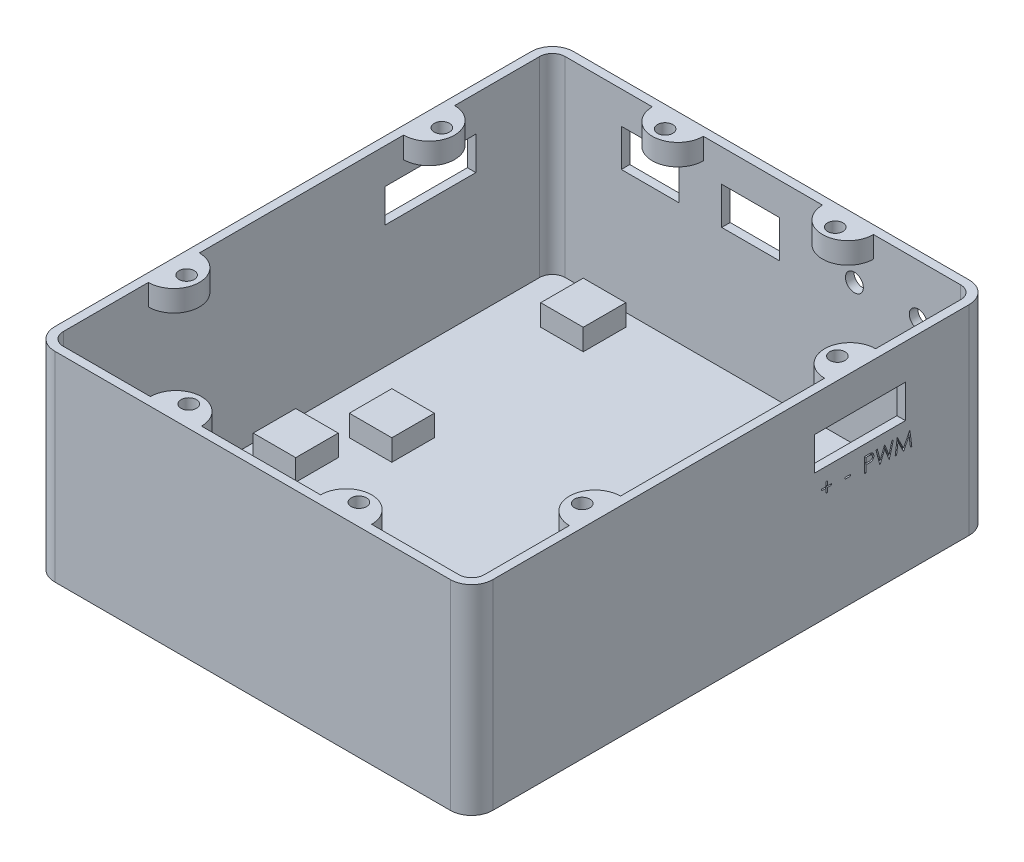
from build123d import *

# Parameters (mm, degrees)
SALIENTE_EXTRUIR2_DEPTH = 47
VACIADO3_T              = -2
CROQUIS2_W              = 10
CROQUIS2_H              = 10
SALIENTE_EXTRUIR3_DEPTH = 5
CROQUIS3_R              = 1.8
SALIENTE_EXTRUIR4_DEPTH = 5
CROQUIS4_W              = 21.34
CROQUIS4_H              = 7.84
CORTAR_EXTRUIR1_DEPTH   = 120
CROQUIS5_R              = 2.1
CROQUIS5_W              = 13.6
CROQUIS5_H              = 8.8
CORTAR_EXTRUIR2_DEPTH   = 2
CORTAR_EXTRUIR3_DEPTH   = 0.4
CROQUIS7_W              = 1.346153846
CROQUIS7_H              = 0.358974359
CORTAR_EXTRUIR4_DEPTH   = 0.4
CROQUIS8_R              = 2.1
CROQUIS8_W              = 13.6
CROQUIS8_H              = 8.8
CORTAR_EXTRUIR5_DEPTH   = 2
CORTAR_EXTRUIR6_DEPTH   = 0.4


with BuildPart() as part:
    # Croquis1 → Saliente-Extruir2 (new body)
    with BuildSketch(Plane(origin=(0, 0, 0), x_dir=(1, 0, 0), z_dir=(0, 1, 0))):
        with BuildLine():
            Line((0, -5), (93, -5))
            ThreePointArc((93, -5), (96.535533906, -3.535533906), (98, 0))
            Line((98, 0), (98, 112))
            ThreePointArc((98, 112), (96.535533906, 115.535533906), (93, 117))
            Line((93, 117), (0, 117))
            ThreePointArc((0, 117), (-3.535533906, 115.535533906), (-5, 112))
            Line((-5, 112), (-5, 0))
            ThreePointArc((-5, 0), (-3.535533906, -3.535533906), (0, -5))
        make_face()
    extrude(amount=SALIENTE_EXTRUIR2_DEPTH)

    # Vaciado3
    vaciado3_openings = [part.faces().sort_by_distance(p)[0] for p in [
        (46.5, 47, -56),
    ]]
    offset(amount=VACIADO3_T, openings=vaciado3_openings, kind=Kind.INTERSECTION)

    # Croquis2 → Saliente-Extruir3 (add)
    with BuildSketch(Plane(origin=(0, 2, 0), x_dir=(1, 0, 0), z_dir=(0, 1, 0))):
        with Locations((5, 5)):
            Rectangle(CROQUIS2_W, CROQUIS2_H)
        with Locations((88, 5)):
            Rectangle(CROQUIS2_W, CROQUIS2_H)
        with Locations((5, 46.653562123)):
            Rectangle(CROQUIS2_W, CROQUIS2_H)
        with Locations((88, 46.653562123)):
            Rectangle(CROQUIS2_W, CROQUIS2_H)
        with Locations((12.25, 62)):
            Rectangle(CROQUIS2_W, CROQUIS2_H)
        with Locations((12.25, 107)):
            Rectangle(CROQUIS2_W, CROQUIS2_H)
        with Locations((80.75, 62)):
            Rectangle(CROQUIS2_W, CROQUIS2_H)
        with Locations((80.75, 107)):
            Rectangle(CROQUIS2_W, CROQUIS2_H)
    extrude(amount=SALIENTE_EXTRUIR3_DEPTH)

    # Croquis3 → Saliente-Extruir4 (add)
    # profile 1 of 8: a face of its own
    with BuildSketch(Plane(origin=(0, 47, 0), x_dir=(1, 0, 0), z_dir=(0, 1, 0))):
        with BuildLine():
            Line((-3, 92), (-3, 80))
            ThreePointArc((-3, 80), (3, 86), (-3, 92))
        make_face()
        with Locations(Location((0, 86, 0), (0, 0, 270))):
            Circle(CROQUIS3_R, mode=Mode.SUBTRACT)
    # profile 2 of 8: a face of its own
    with BuildSketch(Plane(origin=(0, 47, 0), x_dir=(1, 0, 0), z_dir=(0, 1, 0))):
        with BuildLine():
            Line((-3, 32), (-3, 20))
            ThreePointArc((-3, 20), (3, 26), (-3, 32))
        make_face()
        with Locations(Location((0, 26, 0), (0, 0, 270))):
            Circle(CROQUIS3_R, mode=Mode.SUBTRACT)
    # profile 3 of 8: a face of its own
    with BuildSketch(Plane(origin=(0, 47, 0), x_dir=(1, 0, 0), z_dir=(0, 1, 0))):
        with BuildLine():
            Line((32.5, -3), (20.5, -3))
            ThreePointArc((20.5, -3), (26.5, 3), (32.5, -3))
        make_face()
        with Locations(Location((26.5, 0, 0), (0, 0, 270))):
            Circle(CROQUIS3_R, mode=Mode.SUBTRACT)
    # profile 4 of 8: a face of its own
    with BuildSketch(Plane(origin=(0, 47, 0), x_dir=(1, 0, 0), z_dir=(0, 1, 0))):
        with BuildLine():
            Line((72.5, -3), (60.5, -3))
            ThreePointArc((60.5, -3), (66.5, 3), (72.5, -3))
        make_face()
        with Locations(Location((66.5, 0, 0), (0, 0, 270))):
            Circle(CROQUIS3_R, mode=Mode.SUBTRACT)
    # profile 5 of 8: a face of its own
    with BuildSketch(Plane(origin=(0, 47, 0), x_dir=(1, 0, 0), z_dir=(0, 1, 0))):
        with BuildLine():
            Line((96, 32), (96, 20))
            ThreePointArc((96, 20), (90, 26), (96, 32))
        make_face()
        with Locations(Location((93, 26, 0), (0, 0, 270))):
            Circle(CROQUIS3_R, mode=Mode.SUBTRACT)
    # profile 6 of 8: a face of its own
    with BuildSketch(Plane(origin=(0, 47, 0), x_dir=(1, 0, 0), z_dir=(0, 1, 0))):
        with BuildLine():
            Line((96, 92), (96, 80))
            ThreePointArc((96, 80), (90, 86), (96, 92))
        make_face()
        with Locations(Location((93, 86, 0), (0, 0, 270))):
            Circle(CROQUIS3_R, mode=Mode.SUBTRACT)
    # profile 7 of 8: a face of its own
    with BuildSketch(Plane(origin=(0, 47, 0), x_dir=(1, 0, 0), z_dir=(0, 1, 0))):
        with BuildLine():
            Line((20.5, 115), (32.5, 115))
            ThreePointArc((32.5, 115), (26.5, 109), (20.5, 115))
        make_face()
        with Locations(Location((26.5, 112, 0), (0, 0, 270))):
            Circle(CROQUIS3_R, mode=Mode.SUBTRACT)
    # profile 8 of 8: a face of its own
    with BuildSketch(Plane(origin=(0, 47, 0), x_dir=(1, 0, 0), z_dir=(0, 1, 0))):
        with BuildLine():
            Line((60.5, 115), (72.5, 115))
            ThreePointArc((72.5, 115), (66.5, 109), (60.5, 115))
        make_face()
        with Locations(Location((66.5, 112, 0), (0, 0, 270))):
            Circle(CROQUIS3_R, mode=Mode.SUBTRACT)
    extrude(amount=-SALIENTE_EXTRUIR4_DEPTH)

    # Croquis4 → Cortar-Extruir1 (cut)
    with BuildSketch(Plane.ZY.offset(5)):
        with Locations((-86.33, 34.78)):
            Rectangle(CROQUIS4_W, CROQUIS4_H)
    extrude(amount=-CORTAR_EXTRUIR1_DEPTH, mode=Mode.SUBTRACT)

    # Croquis5 → Cortar-Extruir2 (cut)
    with BuildSketch(Plane(origin=(0, 0, -117), x_dir=(-1, 0, 0), z_dir=(0, 0, -1))):
        with Locations((-83, 35)):
            Circle(CROQUIS5_R)
        with Locations((-20, 35)):
            Rectangle(CROQUIS5_W, CROQUIS5_H)
    extrude(amount=-CORTAR_EXTRUIR2_DEPTH, mode=Mode.SUBTRACT)

    # Croquis6 → Cortar-Extruir3 (cut)
    # profile 1 of 7: a face of its own
    with BuildSketch(Plane.ZY.offset(5)):
        with BuildLine():
            Line((-77.400512821, 27.417692308), (-77.176153846, 27.417692308))
            add(Edge.make_bspline(
                [(-77.176153846, 27.417692308), (-77.176003913, 27.458358179), (-77.175720409, 27.535251814), (-77.174046081, 27.644154592), (-77.172917, 27.739983975), (-77.170900213, 27.822725223), (-77.168061799, 27.892135973), (-77.165152124, 27.948212431), (-77.162972583, 27.991308407), (-77.159899719, 28.015525301), (-77.158625801, 28.025564904)],
                knots=[0, 0, 0, 0, 1.604323161, 3.033556972, 4.296844687, 5.385167547, 6.298701784, 7.037230881, 7.60086462, 8, 8, 8, 8], degree=3))
            add(Edge.make_bspline(
                [(-77.158625801, 28.025564904), (-77.152652248, 28.060009514), (-77.14100777, 28.127153717), (-77.102460789, 28.220739137), (-77.046448919, 28.302262753), (-76.987072897, 28.359806431), (-76.932046547, 28.399090043), (-76.885884012, 28.424747575), (-76.835690667, 28.446743924), (-76.781304339, 28.463991697), (-76.723242276, 28.478080923), (-76.66087789, 28.487875054), (-76.594553332, 28.493272479), (-76.548893132, 28.494160615), (-76.525512821, 28.494615385)],
                knots=[0, 0, 0, 0, 1.43722947, 2.801646624, 4.13175475, 5.486897933, 6.18427957, 6.91287343, 7.658885333, 8.438447905, 9.260561323, 10.118602268, 11.036630026, 12, 12, 12, 12], degree=3))
            add(Edge.make_bspline(
                [(-76.525512821, 28.494615385), (-76.489690339, 28.49349749), (-76.415079313, 28.49116914), (-76.300445541, 28.472345867), (-76.178827108, 28.443530481), (-76.096948426, 28.416716043), (-76.054358974, 28.402768429)],
                knots=[0, 0, 0, 0, 0.891275659, 1.856347963, 2.884972697, 4, 4, 4, 4], degree=3))
            Line((-76.054358974, 28.402768429), (-76.054358974, 27.914086538))
            add(Edge.make_bspline(
                [(-76.054358974, 27.914086538), (-76.077202459, 27.920402377), (-76.120770088, 27.932448092), (-76.183457005, 27.945819906), (-76.239939819, 27.954076968), (-76.275423596, 27.955491484), (-76.292039263, 27.956153846)],
                knots=[0, 0, 0, 0, 1.174725213, 2.24046353, 3.176077791, 4, 4, 4, 4], degree=3))
            add(Edge.make_bspline(
                [(-76.292039263, 27.956153846), (-76.310325974, 27.955768488), (-76.344592451, 27.955046386), (-76.392090775, 27.945859837), (-76.432759467, 27.931395208), (-76.453853801, 27.914875554), (-76.463814103, 27.907075321)],
                knots=[0, 0, 0, 0, 1.199997209, 2.248609783, 3.173030359, 4, 4, 4, 4], degree=3))
            add(Edge.make_bspline(
                [(-76.463814103, 27.907075321), (-76.469841327, 27.899376052), (-76.483157434, 27.882365852), (-76.495260921, 27.847655434), (-76.501405726, 27.803784529), (-76.502485389, 27.771317787), (-76.503076923, 27.753529647)],
                knots=[0, 0, 0, 0, 0.721105823, 1.593158367, 2.681320256, 4, 4, 4, 4], degree=3))
            Line((-76.503076923, 27.753529647), (-76.505180288, 27.417692308))
            Line((-76.505180288, 27.417692308), (-76.099230769, 27.417692308))
            Line((-76.099230769, 27.417692308), (-76.099230769, 26.879230769))
            Line((-76.099230769, 26.879230769), (-76.547948718, 26.879230769))
            Line((-76.547948718, 26.879230769), (-76.547948718, 24.86))
            Line((-76.547948718, 24.86), (-77.176153846, 24.86))
            Line((-77.176153846, 24.86), (-77.176153846, 26.879230769))
            Line((-77.176153846, 26.879230769), (-77.400512821, 26.879230769))
            Line((-77.400512821, 26.879230769), (-77.400512821, 27.417692308))
        make_face()
    # profile 2 of 7: a face of its own
    with BuildSketch(Plane.ZY.offset(5)):
        with BuildLine():
            Line((-77.62697516, 25.981794872), (-79.644102564, 25.981794872))
            add(Edge.make_bspline(
                [(-79.644102564, 25.981794872), (-79.639989804, 25.958356996), (-79.631907907, 25.91229972), (-79.614357778, 25.845397531), (-79.591961183, 25.782350037), (-79.565120273, 25.723072959), (-79.534287588, 25.667252923), (-79.498323814, 25.615151746), (-79.457685121, 25.566815448), (-79.412606469, 25.522454103), (-79.363839239, 25.482705377), (-79.311619934, 25.44788298), (-79.255894665, 25.419330745), (-79.197302303, 25.395264173), (-79.135405028, 25.37620101), (-79.070111742, 25.363053509), (-79.001595529, 25.355287233), (-78.954920191, 25.354163929), (-78.931061699, 25.353589744)],
                knots=[0, 0, 0, 0, 1.091296461, 2.144483647, 3.168565212, 4.157007626, 5.126487748, 6.090021542, 7.05641414, 8.019231907, 8.98705074, 9.938580405, 10.892824166, 11.854447369, 12.841318655, 13.858982407, 14.905600794, 16, 16, 16, 16], degree=3))
            add(Edge.make_bspline(
                [(-78.931061699, 25.353589744), (-78.902262878, 25.35435006), (-78.84554952, 25.355847348), (-78.762464028, 25.369126063), (-78.682108255, 25.38918298), (-78.605242648, 25.419009298), (-78.530976841, 25.456137822), (-78.460533478, 25.502395393), (-78.392693238, 25.556430216), (-78.351302696, 25.598080236), (-78.330200321, 25.619314904)],
                knots=[0, 0, 0, 0, 1.021034703, 2.010718019, 2.977989445, 3.954245119, 4.929443971, 5.918328161, 6.938689359, 8, 8, 8, 8], degree=3))
            Line((-78.330200321, 25.619314904), (-77.804358974, 25.369014423))
            add(Edge.make_bspline(
                [(-77.804358974, 25.369014423), (-77.820914782, 25.346136838), (-77.853719507, 25.300805743), (-77.907272119, 25.237013186), (-77.963157679, 25.177492141), (-78.021417867, 25.12263409), (-78.082126572, 25.072595354), (-78.145114917, 25.026766372), (-78.21130345, 24.986377634), (-78.279368743, 24.949475157), (-78.350717833, 24.917838835), (-78.425153265, 24.890860496), (-78.502359763, 24.866472307), (-78.583312278, 24.847889843), (-78.667336719, 24.833180116), (-78.75463409, 24.822734261), (-78.845192884, 24.816282357), (-78.906745169, 24.815517492), (-78.938072917, 24.815128205)],
                knots=[0, 0, 0, 0, 1.028154879, 2.037251081, 3.030720504, 4.000128189, 4.949298328, 5.894184978, 6.834267904, 7.770992897, 8.712077017, 9.673380525, 10.653304757, 11.658697181, 12.695551717, 13.758623199, 14.859225354, 16, 16, 16, 16], degree=3))
            add(Edge.make_bspline(
                [(-78.938072917, 24.815128205), (-78.986270142, 24.816110802), (-79.080661629, 24.81803516), (-79.218726242, 24.83589596), (-79.349849331, 24.865511093), (-79.474401142, 24.905768317), (-79.591843278, 24.958920464), (-79.702233862, 25.023929949), (-79.806675854, 25.09955041), (-79.901977968, 25.18736892), (-79.988801006, 25.282954147), (-80.065060964, 25.385606153), (-80.128874211, 25.494607748), (-80.181278933, 25.609237537), (-80.222009703, 25.729788926), (-80.251374226, 25.856314522), (-80.26937503, 25.988753894), (-80.271319206, 26.078959891), (-80.272307692, 26.124823718)],
                knots=[0, 0, 0, 0, 1.103565453, 2.161269334, 3.182010356, 4.179077853, 5.15417608, 6.128274628, 7.109042802, 8.101804412, 9.090965879, 10.063106201, 11.02526161, 11.978650795, 12.945248442, 13.93468508, 14.949922959, 16, 16, 16, 16], degree=3))
            add(Edge.make_bspline(
                [(-80.272307692, 26.124823718), (-80.271309478, 26.171853003), (-80.269345535, 26.264381011), (-80.251529213, 26.399878469), (-80.22192852, 26.529161371), (-80.181078604, 26.652407752), (-80.129468868, 26.770003076), (-80.064843707, 26.880918523), (-79.98883885, 26.985540241), (-79.90232859, 27.083378799), (-79.806622747, 27.171688786), (-79.704926247, 27.250390633), (-79.596096424, 27.315970236), (-79.481364239, 27.368958515), (-79.36146356, 27.412010153), (-79.235008503, 27.440657423), (-79.102961197, 27.45989235), (-79.012696566, 27.461663767), (-78.96681891, 27.462564103)],
                knots=[0, 0, 0, 0, 1.079208495, 2.12329425, 3.130605359, 4.119693003, 5.099659317, 6.073216462, 7.060498243, 8.06384408, 9.066070512, 10.045757761, 11.010926815, 11.975797609, 12.942977511, 13.929384301, 14.947594487, 16, 16, 16, 16], degree=3))
            add(Edge.make_bspline(
                [(-78.96681891, 27.462564103), (-78.918390788, 27.461566262), (-78.823307161, 27.459607105), (-78.68428097, 27.44189133), (-78.552287239, 27.412095608), (-78.426763602, 27.372186481), (-78.309313046, 27.317691654), (-78.197354826, 27.25428195), (-78.093574337, 27.177026895), (-77.996865387, 27.089638141), (-77.909565795, 26.992683347), (-77.833256279, 26.887360745), (-77.768326272, 26.774698223), (-77.715699858, 26.65423891), (-77.675010911, 26.526344436), (-77.645619206, 26.391180898), (-77.627755705, 26.248234198), (-77.625847705, 26.150350399), (-77.624871795, 26.100284455)],
                knots=[0, 0, 0, 0, 1.080001299, 2.120471247, 3.119684163, 4.095710327, 5.052285597, 6.002875087, 6.961153713, 7.931888285, 8.906493152, 9.865905668, 10.82813294, 11.801621613, 12.7925306, 13.817193356, 14.883530496, 16, 16, 16, 16], degree=3))
            Line((-77.624871795, 26.100284455), (-77.62697516, 25.981794872))
        make_face()
        with BuildLine():
            add(Edge.make_bspline(
                [(-78.253076923, 26.475384615), (-78.264931538, 26.507375419), (-78.288501601, 26.570981471), (-78.341745392, 26.658742302), (-78.412398198, 26.734746746), (-78.494572481, 26.802034083), (-78.588461745, 26.856648688), (-78.691107374, 26.896191437), (-78.801211948, 26.919901765), (-78.876957962, 26.92268257), (-78.915637019, 26.924102564)],
                knots=[0, 0, 0, 0, 0.954238005, 1.897273737, 2.851915805, 3.847685534, 4.862635127, 5.880135777, 6.917509367, 8, 8, 8, 8], degree=3))
            add(Edge.make_bspline(
                [(-78.915637019, 26.924102564), (-78.957880848, 26.922738487), (-79.040458736, 26.920071999), (-79.159571718, 26.891712926), (-79.271928013, 26.849387857), (-79.338166917, 26.805749811), (-79.371366186, 26.783878205)],
                knots=[0, 0, 0, 0, 1.044195649, 2.041185066, 3.018232172, 4, 4, 4, 4], degree=3))
            add(Edge.make_bspline(
                [(-79.371366186, 26.783878205), (-79.39208005, 26.767220311), (-79.436240951, 26.731706531), (-79.493592839, 26.660859913), (-79.550084927, 26.575080563), (-79.582203793, 26.509925086), (-79.599230769, 26.475384615)],
                knots=[0, 0, 0, 0, 0.82159062, 1.751589201, 2.808063854, 4, 4, 4, 4], degree=3))
            Line((-79.599230769, 26.475384615), (-78.253076923, 26.475384615))
        make_face(mode=Mode.SUBTRACT)
    # profile 3 of 7: a face of its own
    with BuildSketch(Plane.ZY.offset(5)):
        with BuildLine():
            Line((-82.91974359, 28.36), (-82.187772436, 28.36))
            add(Edge.make_bspline(
                [(-82.187772436, 28.36), (-82.139389365, 28.359828268), (-82.046335092, 28.359497979), (-81.912155913, 28.354286889), (-81.788893884, 28.34703523), (-81.676366504, 28.335969006), (-81.574621916, 28.32129653), (-81.483558147, 28.304000109), (-81.403177859, 28.28428713), (-81.332803155, 28.259723202), (-81.269293464, 28.232015463), (-81.210093603, 28.200178764), (-81.153897534, 28.164567615), (-81.101080868, 28.124244991), (-81.051184615, 28.079936286), (-81.004114643, 28.031596899), (-80.960536094, 27.978816932), (-80.920718809, 27.921929887), (-80.884428559, 27.86208602), (-80.852355589, 27.799203166), (-80.826273796, 27.733237592), (-80.803227736, 27.665142645), (-80.786628406, 27.593944894), (-80.775083815, 27.520337461), (-80.766631317, 27.44406124), (-80.766145339, 27.392242562), (-80.765897436, 27.365809295)],
                knots=[0, 0, 0, 0, 1.749336639, 3.364467119, 4.854658419, 6.213483162, 7.451590619, 8.570285859, 9.5643256, 10.440900261, 11.26203566, 12.067320669, 12.869050712, 13.665104639, 14.467235401, 15.27997916, 16.102287765, 16.939272006, 17.78853747, 18.631303466, 19.488103222, 20.351255419, 21.228522269, 22.127379805, 23.044756219, 24, 24, 24, 24], degree=3))
            add(Edge.make_bspline(
                [(-80.765897436, 27.365809295), (-80.766541398, 27.338219036), (-80.767804091, 27.284119568), (-80.774605639, 27.204651861), (-80.787036733, 27.128622717), (-80.805865434, 27.056254741), (-80.827506579, 26.986647229), (-80.856283752, 26.921084482), (-80.888761635, 26.858612986), (-80.927334669, 26.800116424), (-80.969666688, 26.744295469), (-81.018897936, 26.693288831), (-81.071838984, 26.644355094), (-81.131465842, 26.600559303), (-81.195150101, 26.558940145), (-81.264157102, 26.521222103), (-81.33803648, 26.486457035), (-81.389977341, 26.467069631), (-81.416538462, 26.457155449)],
                knots=[0, 0, 0, 0, 1.099860209, 2.156625411, 3.176576793, 4.16617041, 5.135385252, 6.078461593, 7.016046972, 7.938469504, 8.868247731, 9.803980173, 10.76021508, 11.73834243, 12.748633912, 13.790971185, 14.870363756, 16, 16, 16, 16], degree=3))
            Line((-81.416538462, 26.457155449), (-80.608846154, 24.86))
            Line((-80.608846154, 24.86), (-81.307163462, 24.86))
            Line((-81.307163462, 24.86), (-82.078397436, 26.385641026))
            Line((-82.078397436, 26.385641026), (-82.291538462, 26.385641026))
            Line((-82.291538462, 26.385641026), (-82.291538462, 24.86))
            Line((-82.291538462, 24.86), (-82.91974359, 24.86))
            Line((-82.91974359, 24.86), (-82.91974359, 28.36))
        make_face()
        with BuildLine():
            Line((-82.291538462, 27.013846154), (-82.046846955, 27.013846154))
            add(Edge.make_bspline(
                [(-82.046846955, 27.013846154), (-82.016931384, 27.014183083), (-81.959649495, 27.01482823), (-81.877270614, 27.01782069), (-81.802450944, 27.02503104), (-81.734869183, 27.034141047), (-81.674185267, 27.044659866), (-81.620940475, 27.059733972), (-81.574314386, 27.075886258), (-81.53485952, 27.09595936), (-81.501150189, 27.118786831), (-81.472044339, 27.144719405), (-81.447969628, 27.174733058), (-81.428154913, 27.208012147), (-81.412741219, 27.244851019), (-81.401490403, 27.284845265), (-81.395202861, 27.328450472), (-81.394479458, 27.358544002), (-81.394102564, 27.374222756)],
                knots=[0, 0, 0, 0, 1.688639943, 3.233382647, 4.650958383, 5.928841754, 7.082724185, 8.122798841, 9.049171256, 9.863274652, 10.613301712, 11.341792392, 12.054588806, 12.776240173, 13.521029143, 14.301969904, 15.115324896, 16, 16, 16, 16], degree=3))
            add(Edge.make_bspline(
                [(-81.394102564, 27.374222756), (-81.394815116, 27.392771868), (-81.396214792, 27.429208159), (-81.41010393, 27.481663643), (-81.432212437, 27.530214782), (-81.462517144, 27.57464221), (-81.500681983, 27.61359036), (-81.544479147, 27.647923465), (-81.594853884, 27.675071516), (-81.6414971, 27.692978081), (-81.683931524, 27.703691763), (-81.722227252, 27.711675505), (-81.766573937, 27.717333812), (-81.817005057, 27.723335453), (-81.873392061, 27.727227214), (-81.936042292, 27.730067423), (-82.00477582, 27.731229493), (-82.052689616, 27.731600986), (-82.077696314, 27.731794872)],
                knots=[0, 0, 0, 0, 1.020303359, 2.004196876, 2.966617323, 3.9489082, 4.950758222, 5.960522915, 7.003732012, 8.091992268, 8.70421221, 9.413913587, 10.24622431, 11.166358409, 12.212345909, 13.359657661, 14.621978493, 16, 16, 16, 16], degree=3))
            Line((-82.077696314, 27.731794872), (-82.291538462, 27.731794872))
            Line((-82.291538462, 27.731794872), (-82.291538462, 27.013846154))
        make_face(mode=Mode.SUBTRACT)
    # profile 4 of 7: a face of its own
    with BuildSketch(Plane.ZY.offset(5)):
        with BuildLine():
            Line((-86.554358974, 27.193333333), (-87.182564103, 27.193333333))
            add(Edge.make_bspline(
                [(-87.182564103, 27.193333333), (-87.179850981, 27.240853728), (-87.174549704, 27.333705726), (-87.153462565, 27.468576225), (-87.125206523, 27.596014017), (-87.087495083, 27.715573308), (-87.040108192, 27.827210656), (-86.984265235, 27.931306638), (-86.918539553, 28.027313186), (-86.844330004, 28.114767303), (-86.762896462, 28.193223199), (-86.675929567, 28.262787125), (-86.582099044, 28.320189525), (-86.483119253, 28.367426387), (-86.379007048, 28.405166444), (-86.268777363, 28.430398727), (-86.153384629, 28.447486275), (-86.074388958, 28.448981504), (-86.034126603, 28.44974359)],
                knots=[0, 0, 0, 0, 1.199038563, 2.342849363, 3.436047546, 4.486744587, 5.497670872, 6.488682221, 7.459191391, 8.424610317, 9.374430501, 10.305433194, 11.225809216, 12.140057399, 13.06607119, 14.010487599, 14.985989317, 16, 16, 16, 16], degree=3))
            add(Edge.make_bspline(
                [(-86.034126603, 28.44974359), (-85.984705133, 28.44820151), (-85.888222843, 28.445191008), (-85.748026422, 28.419510428), (-85.617098294, 28.376555691), (-85.49553363, 28.316536594), (-85.384367333, 28.240288623), (-85.283617836, 28.149375396), (-85.196331965, 28.041889507), (-85.121956302, 27.922303267), (-85.060159015, 27.79567827), (-85.016854051, 27.664742772), (-84.988390164, 27.53297127), (-84.985354314, 27.444243011), (-84.983846154, 27.400164263)],
                knots=[0, 0, 0, 0, 1.075374347, 2.099382735, 3.09057751, 4.06680945, 5.040638231, 6.016817125, 7.011024321, 8.044445721, 9.0776792, 10.070479129, 11.0414456, 12, 12, 12, 12], degree=3))
            add(Edge.make_bspline(
                [(-84.983846154, 27.400164263), (-84.984433352, 27.373502321), (-84.985615237, 27.319838418), (-84.993833037, 27.238631761), (-85.006161362, 27.155913287), (-85.024749472, 27.071753919), (-85.047930368, 26.986130065), (-85.076052147, 26.898785484), (-85.109767119, 26.810215386), (-85.14851265, 26.719422931), (-85.194736167, 26.626113351), (-85.248557028, 26.528887899), (-85.31140376, 26.427832821), (-85.382517253, 26.322377529), (-85.46224289, 26.21268834), (-85.550969863, 26.099095673), (-85.647676248, 25.981199265), (-85.71631149, 25.902392132), (-85.751574519, 25.861903045)],
                knots=[0, 0, 0, 0, 0.728284026, 1.46585585, 2.227944881, 3.01186502, 3.81876927, 4.650621989, 5.517437689, 6.406905708, 7.346299482, 8.360816762, 9.441613733, 10.596154504, 11.834900912, 13.145207542, 14.533280747, 16, 16, 16, 16], degree=3))
            Line((-85.751574519, 25.861903045), (-86.116858974, 25.443333333))
            Line((-86.116858974, 25.443333333), (-84.938974359, 25.443333333))
            Line((-84.938974359, 25.443333333), (-84.938974359, 24.86))
            Line((-84.938974359, 24.86), (-87.272307692, 24.86))
            Line((-87.272307692, 24.86), (-87.272307692, 25.178309295))
            Line((-87.272307692, 25.178309295), (-86.236049679, 26.281173878))
            add(Edge.make_bspline(
                [(-86.236049679, 26.281173878), (-86.206047347, 26.313344781), (-86.147941726, 26.375650278), (-86.065263417, 26.46715253), (-85.990446849, 26.553985982), (-85.925043407, 26.637075237), (-85.865620802, 26.713725216), (-85.814828683, 26.786246247), (-85.772202342, 26.853982712), (-85.725925403, 26.935661059), (-85.681977523, 27.033077022), (-85.641652683, 27.145304206), (-85.617071903, 27.252567547), (-85.613678978, 27.322462646), (-85.612051282, 27.35599359)],
                knots=[0, 0, 0, 0, 1.246127091, 2.413378631, 3.493388633, 4.492180848, 5.408488754, 6.240484944, 6.999099869, 7.674939598, 8.898438119, 10.020720584, 11.050475521, 12, 12, 12, 12], degree=3))
            add(Edge.make_bspline(
                [(-85.612051282, 27.35599359), (-85.613268271, 27.388432191), (-85.615626382, 27.451287182), (-85.641540116, 27.540698073), (-85.68168657, 27.621650506), (-85.738258594, 27.691725534), (-85.806785034, 27.749310831), (-85.885973771, 27.792141156), (-85.975179186, 27.816854058), (-86.037713881, 27.819947231), (-86.069883814, 27.821538462)],
                knots=[0, 0, 0, 0, 1.062038974, 2.057870785, 3.028805853, 4.01125022, 4.991535629, 5.949134679, 6.94496649, 8, 8, 8, 8], degree=3))
            add(Edge.make_bspline(
                [(-86.069883814, 27.821538462), (-86.086503211, 27.820950642), (-86.119221163, 27.819793424), (-86.167313995, 27.812090139), (-86.21307778, 27.798513903), (-86.257021894, 27.780323658), (-86.298677354, 27.756212358), (-86.337939092, 27.726491338), (-86.37522078, 27.691915879), (-86.410351429, 27.652594092), (-86.442324905, 27.608710967), (-86.47072363, 27.560667285), (-86.494204648, 27.50849287), (-86.51487819, 27.452876502), (-86.530822614, 27.393220817), (-86.542432134, 27.329882848), (-86.551258076, 27.262965636), (-86.553306538, 27.216966346), (-86.554358974, 27.193333333)],
                knots=[0, 0, 0, 0, 0.903469896, 1.778625579, 2.63899355, 3.493148037, 4.358286772, 5.247621495, 6.164656832, 7.118446693, 8.109501108, 9.111810964, 10.146451449, 11.215617525, 12.33435995, 13.498009769, 14.714554818, 16, 16, 16, 16], degree=3))
        make_face()
    # profile 5 of 7: a face of its own
    with BuildSketch(Plane.ZY.offset(5)):
        Polygon((-89.471025641, 28.36), (-87.586410256, 28.36), (-87.586410256, 27.731794872), (-88.842820513, 27.731794872), (-88.842820513, 27.058717949), (-87.586410256, 27.058717949), (-87.586410256, 26.430512821), (-88.842820513, 26.430512821), (-88.842820513, 25.488205128), (-87.586410256, 25.488205128), (-87.586410256, 24.86), (-89.471025641, 24.86), align=None)
    # profile 6 of 7: a face of its own
    with BuildSketch(Plane.ZY.offset(5)):
        Polygon((-93.134387019, 28.36), (-92.163333333, 28.36), (-92.163333333, 24.86), (-92.791538462, 24.86), (-92.791538462, 27.776666667), (-93.509487179, 27.776666667), align=None)
    # profile 7 of 7: a face of its own
    with BuildSketch(Plane.ZY.offset(5)):
        Polygon((-96.022307692, 28.36), (-94.137692308, 28.36), (-94.137692308, 27.731794872), (-95.394102564, 27.731794872), (-95.394102564, 27.058717949), (-94.137692308, 27.058717949), (-94.137692308, 26.430512821), (-95.394102564, 26.430512821), (-95.394102564, 25.488205128), (-94.137692308, 25.488205128), (-94.137692308, 24.86), (-96.022307692, 24.86), align=None)
    extrude(amount=-CORTAR_EXTRUIR3_DEPTH, mode=Mode.SUBTRACT)

    # Croquis7 → Cortar-Extruir4 (cut)
    # profile 1 of 5: a face of its own
    with BuildSketch(Plane(origin=(98, 0, 0), x_dir=(0, 0, -1), z_dir=(1, 0, 0))):
        Polygon((78.307435897, 26.744615385), (78.307435897, 27.776666667), (78.621538462, 27.776666667), (78.621538462, 26.744615385), (79.653589744, 26.744615385), (79.653589744, 26.430512821), (78.621538462, 26.430512821), (78.621538462, 25.398461538), (78.307435897, 25.398461538), (78.307435897, 26.430512821), (77.275384615, 26.430512821), (77.275384615, 26.744615385), align=None)
    # profile 2 of 5: a face of its own
    with BuildSketch(Plane(origin=(98, 0, 0), x_dir=(0, 0, -1), z_dir=(1, 0, 0))):
        with Locations((83.467692308, 26.206153847)):
            Rectangle(CROQUIS7_W, CROQUIS7_H)
    # profile 3 of 5: a face of its own
    with BuildSketch(Plane(origin=(98, 0, 0), x_dir=(0, 0, -1), z_dir=(1, 0, 0))):
        with BuildLine():
            Line((87.416410256, 28.36), (88.102808494, 28.36))
            add(Edge.make_bspline(
                [(88.102808494, 28.36), (88.1500194, 28.359948104), (88.240477593, 28.359848668), (88.370192648, 28.356833922), (88.48800238, 28.35280723), (88.593652761, 28.347225337), (88.687468859, 28.340628747), (88.769026158, 28.331376708), (88.838965715, 28.321716412), (88.880872164, 28.311895005), (88.899983974, 28.307415865)],
                knots=[0, 0, 0, 0, 1.415646017, 2.712440637, 3.8905458, 4.950247383, 5.884950622, 6.709939814, 7.411656543, 8, 8, 8, 8], degree=3))
            add(Edge.make_bspline(
                [(88.899983974, 28.307415865), (88.924177508, 28.300793916), (88.971994485, 28.287706054), (89.040895528, 28.26149233), (89.106449374, 28.230410165), (89.168880932, 28.194986225), (89.227423015, 28.153700661), (89.282949056, 28.108227043), (89.334969037, 28.057515475), (89.383190429, 28.002134735), (89.427475226, 27.943014525), (89.465604909, 27.879272295), (89.497532136, 27.811980992), (89.524915407, 27.741187421), (89.544623862, 27.666297097), (89.559470762, 27.587830385), (89.568894389, 27.505795695), (89.569796951, 27.449735827), (89.57025641, 27.421197917)],
                knots=[0, 0, 0, 0, 0.999701418, 1.975846123, 2.934577507, 3.890451536, 4.834027766, 5.787354733, 6.749476667, 7.726910423, 8.712836071, 9.690891519, 10.682875813, 11.679750201, 12.712814741, 13.765529915, 14.8625177, 16, 16, 16, 16], degree=3))
            add(Edge.make_bspline(
                [(89.57025641, 27.421197917), (89.569834986, 27.39242014), (89.56901044, 27.336114476), (89.559114154, 27.253741688), (89.545783963, 27.175023298), (89.52528691, 27.100133847), (89.498441237, 27.029518077), (89.466949184, 26.962096845), (89.428965654, 26.899017173), (89.385320824, 26.840050055), (89.33676923, 26.785140143), (89.283516292, 26.734685348), (89.225776999, 26.68898101), (89.163734851, 26.647924666), (89.096785002, 26.612468387), (89.025942849, 26.580711082), (88.950592632, 26.554040021), (88.898450118, 26.54000996), (88.871939103, 26.532876603)],
                knots=[0, 0, 0, 0, 1.121902311, 2.195077645, 3.232258892, 4.234102512, 5.217864754, 6.176164875, 7.132989551, 8.084763148, 9.034132444, 9.988522005, 10.94243251, 11.903244335, 12.886203696, 13.894208494, 14.929344452, 16, 16, 16, 16], degree=3))
            add(Edge.make_bspline(
                [(88.871939103, 26.532876603), (88.850011769, 26.528213621), (88.801956741, 26.517994427), (88.722814019, 26.50658597), (88.630668633, 26.49684837), (88.525646353, 26.489547232), (88.407841448, 26.483296864), (88.277190191, 26.47832877), (88.133436114, 26.475598916), (88.03316487, 26.475458123), (87.980813301, 26.475384615)],
                knots=[0, 0, 0, 0, 0.601384939, 1.31797006, 2.144135048, 3.087295005, 4.142315834, 5.309527816, 6.595305764, 8, 8, 8, 8], degree=3))
            Line((87.980813301, 26.475384615), (87.730512821, 26.475384615))
            Line((87.730512821, 26.475384615), (87.730512821, 24.86))
            Line((87.730512821, 24.86), (87.416410256, 24.86))
            Line((87.416410256, 24.86), (87.416410256, 28.36))
        make_face()
        with BuildLine():
            Line((87.730512821, 28.001025641), (87.730512821, 26.834358974))
            Line((87.730512821, 26.834358974), (88.343293269, 26.826646635))
            add(Edge.make_bspline(
                [(88.343293269, 26.826646635), (88.373213195, 26.826631171), (88.430972995, 26.826601319), (88.514409218, 26.830586542), (88.591818506, 26.835187075), (88.662963081, 26.841922998), (88.727875015, 26.851444256), (88.786662544, 26.861055994), (88.838869827, 26.874961356), (88.899969029, 26.893684426), (88.968052376, 26.925617041), (89.042119925, 26.971966931), (89.104890511, 27.03104764), (89.159208808, 27.097475471), (89.202314686, 27.1713746), (89.233870678, 27.250443537), (89.252411836, 27.333871387), (89.254898029, 27.390959525), (89.256153846, 27.419795673)],
                knots=[0, 0, 0, 0, 1.160613943, 2.240541288, 3.23993089, 4.169200891, 5.011653406, 5.7853311, 6.478053781, 7.106038997, 8.262395093, 9.384106736, 10.481365981, 11.59014053, 12.70357646, 13.786202915, 14.881775077, 16, 16, 16, 16], degree=3))
            add(Edge.make_bspline(
                [(89.256153846, 27.419795673), (89.2548912, 27.447934187), (89.252381215, 27.503870069), (89.233725352, 27.585848829), (89.202376038, 27.664084534), (89.158919443, 27.737057619), (89.106178313, 27.803246423), (89.04487897, 27.86074355), (88.975165709, 27.906965253), (88.910317478, 27.936798534), (88.852716292, 27.95501381), (88.802684332, 27.96775865), (88.746193657, 27.977934257), (88.683225878, 27.986173759), (88.614269044, 27.993227221), (88.538730729, 27.998013198), (88.456897086, 28.000814654), (88.400086515, 28.000953609), (88.370637019, 28.001025641)],
                knots=[0, 0, 0, 0, 1.120700087, 2.227813068, 3.331159281, 4.466773991, 5.599788987, 6.693661531, 7.80175334, 8.91857717, 9.525282508, 10.207424825, 10.974604443, 11.810962634, 12.737642355, 13.736264703, 14.826523623, 16, 16, 16, 16], degree=3))
            Line((88.370637019, 28.001025641), (87.730512821, 28.001025641))
        make_face(mode=Mode.SUBTRACT)
    # profile 4 of 5: a face of its own
    with BuildSketch(Plane(origin=(98, 0, 0), x_dir=(0, 0, -1), z_dir=(1, 0, 0))):
        Polygon((90.063846154, 28.36), (90.388465545, 28.36), (91.073461538, 25.793193109), (92.092191506, 28.36), (92.137764423, 28.36), (93.137564103, 25.810721154), (93.826065705, 28.36), (94.147179487, 28.36), (93.203469551, 24.86), (93.158597756, 24.86), (92.105512821, 27.536883013), (91.039807692, 24.86), (90.994935897, 24.86), align=None)
    # profile 5 of 5: a face of its own
    with BuildSketch(Plane(origin=(98, 0, 0), x_dir=(0, 0, -1), z_dir=(1, 0, 0))):
        Polygon((94.595897436, 24.86), (95.057936699, 28.36), (95.102808494, 28.36), (96.547820513, 25.488205128), (97.989326923, 28.36), (98.03489984, 28.36), (98.49974359, 24.86), (98.184238782, 24.86), (97.849102564, 27.378429487), (96.58568109, 24.86), (96.514867788, 24.86), (95.246538462, 27.384038462), (94.912103365, 24.86), align=None)
    extrude(amount=-CORTAR_EXTRUIR4_DEPTH, mode=Mode.SUBTRACT)

    # Croquis8 → Cortar-Extruir5 (cut)
    with BuildSketch(Plane(origin=(0, 0, -117), x_dir=(-1, 0, 0), z_dir=(0, 0, -1))):
        with Locations((-68, 35)):
            Circle(CROQUIS8_R)
        with Locations((-43.6, 35)):
            Rectangle(CROQUIS8_W, CROQUIS8_H)
    extrude(amount=-CORTAR_EXTRUIR5_DEPTH, mode=Mode.SUBTRACT)

    # Croquis9 → Cortar-Extruir6 (cut)
    # profile 1 of 16: a face of its own
    with BuildSketch(Plane(origin=(0, 0, -117), x_dir=(-1, 0, 0), z_dir=(0, 0, -1))):
        Polygon((-87.243717886, 27.245833333), (-86.750804224, 27.245833333), (-86.147117492, 25.400322182), (-85.539190643, 27.245833333), (-85.051047113, 27.245833333), (-84.603714715, 24.6), (-85.084438039, 24.6), (-85.366935868, 26.271136318), (-85.917091117, 24.6), (-86.380323956, 24.6), (-86.927299116, 26.271136318), (-87.209266931, 24.6), (-87.69052027, 24.6), align=None)
    # profile 2 of 16: a face of its own
    with BuildSketch(Plane(origin=(0, 0, -117), x_dir=(-1, 0, 0), z_dir=(0, 0, -1))):
        with BuildLine():
            add(Edge.make_bspline(
                [(-83.309418841, 26.56741453), (-83.286966809, 26.567014981), (-83.242501612, 26.566223692), (-83.176276257, 26.559636937), (-83.111208673, 26.548890375), (-83.046924861, 26.534975452), (-82.984021757, 26.515478565), (-82.922169441, 26.492095063), (-82.860814875, 26.465248068), (-82.801480867, 26.433290754), (-82.743738772, 26.398630132), (-82.688995831, 26.360396622), (-82.637706644, 26.318890536), (-82.58891911, 26.275074224), (-82.544906807, 26.227040067), (-82.502857113, 26.177102553), (-82.465041869, 26.123472594), (-82.430030401, 26.067457029), (-82.398859942, 26.009379785), (-82.371794132, 25.949644867), (-82.348303553, 25.889078153), (-82.329910901, 25.8269419), (-82.31468348, 25.764055455), (-82.305073895, 25.699648194), (-82.298242146, 25.634381739), (-82.297476091, 25.590438991), (-82.297090783, 25.568336839)],
                knots=[0, 0, 0, 0, 1.022364134, 2.024744242, 3.027414945, 4.024939316, 5.017584196, 6.023349371, 7.035562955, 8.064994934, 9.090267829, 10.101425541, 11.102933353, 12.093946398, 13.084502048, 14.067315274, 15.065326281, 16.070028806, 17.074376865, 18.064572984, 19.055292013, 20.030201733, 21.013838017, 21.999348303, 22.993720005, 24, 24, 24, 24], degree=3))
            add(Edge.make_bspline(
                [(-82.297090783, 25.568336839), (-82.297497411, 25.546062014), (-82.298305881, 25.501774612), (-82.30482673, 25.435894245), (-82.315614427, 25.371184107), (-82.329582756, 25.307262976), (-82.34900668, 25.244948787), (-82.371701463, 25.183323002), (-82.399560202, 25.123225605), (-82.43036009, 25.064000989), (-82.465596667, 25.007391954), (-82.503379177, 24.953224752), (-82.545252747, 24.902920444), (-82.58891272, 24.854918953), (-82.636429986, 24.810843475), (-82.687046082, 24.769978341), (-82.740322812, 24.731823956), (-82.796643293, 24.697275495), (-82.855286153, 24.666918995), (-82.915262392, 24.639550132), (-82.976922717, 24.6167636), (-83.040139519, 24.59818181), (-83.104951136, 24.583794396), (-83.171214482, 24.574020854), (-83.238786849, 24.567223468), (-83.28431445, 24.566462985), (-83.307298782, 24.56607906)],
                knots=[0, 0, 0, 0, 1.012026251, 2.012137606, 3.004615893, 3.992048833, 4.982446996, 5.968083444, 6.973977695, 7.990229942, 8.999482246, 10.001782172, 10.988562221, 11.971415814, 12.948383116, 13.930088534, 14.925840678, 15.924049238, 16.929462851, 17.924729459, 18.917889337, 19.913673841, 20.916777188, 21.931792057, 22.95587778, 24, 24, 24, 24], degree=3))
            add(Edge.make_bspline(
                [(-83.307298782, 24.56607906), (-83.340906563, 24.567065514), (-83.407148011, 24.569009832), (-83.504706003, 24.582327895), (-83.598427029, 24.605251774), (-83.688463806, 24.637207157), (-83.774933294, 24.678156788), (-83.857080857, 24.728838176), (-83.935723638, 24.788253548), (-84.009499486, 24.85590072), (-84.077088158, 24.930115795), (-84.136134994, 25.009339934), (-84.186270536, 25.092385702), (-84.227449678, 25.179347799), (-84.259231578, 25.270345474), (-84.282183533, 25.365106674), (-84.295517879, 25.46389776), (-84.297445752, 25.531019274), (-84.298426253, 25.565156751)],
                knots=[0, 0, 0, 0, 1.029999031, 2.030143771, 3.011211297, 3.982305373, 4.953580601, 5.938004764, 6.935448627, 7.970290061, 9.001484052, 10.007591832, 10.993831261, 11.969999897, 12.951306496, 13.942897864, 14.953773953, 16, 16, 16, 16], degree=3))
            add(Edge.make_bspline(
                [(-84.298426253, 25.565156751), (-84.297411559, 25.601608092), (-84.295417198, 25.673252475), (-84.279581096, 25.778213127), (-84.254292549, 25.878707978), (-84.217992432, 25.974455911), (-84.171622226, 26.06563352), (-84.115014713, 26.152048501), (-84.047890136, 26.233720429), (-83.996486151, 26.283118411), (-83.97034716, 26.308237346)],
                knots=[0, 0, 0, 0, 1.043912699, 2.05178951, 3.033892, 4.007821512, 4.978932272, 5.95884105, 6.962068106, 8, 8, 8, 8], degree=3))
            add(Edge.make_bspline(
                [(-83.97034716, 26.308237346), (-83.946362023, 26.329058119), (-83.899044312, 26.370133193), (-83.822168607, 26.42223019), (-83.743456559, 26.467226102), (-83.661964771, 26.50422111), (-83.577466065, 26.532114749), (-83.490393449, 26.552418823), (-83.400765028, 26.56489018), (-83.340022307, 26.566568804), (-83.309418841, 26.56741453)],
                knots=[0, 0, 0, 0, 1.048115528, 2.067714963, 3.060638214, 4.039924844, 5.017819947, 5.994373833, 6.98952318, 8, 8, 8, 8], degree=3))
        make_face()
        with BuildLine():
            add(Edge.make_bspline(
                [(-83.298818547, 26.126442308), (-83.317205107, 26.125831199), (-83.353399249, 26.124628226), (-83.406677976, 26.118172189), (-83.457069557, 26.104939987), (-83.505574863, 26.088112248), (-83.55133583, 26.065607517), (-83.595605688, 26.039271797), (-83.636082502, 26.006315883), (-83.674725074, 25.970165656), (-83.709803916, 25.9300218), (-83.739694421, 25.886285098), (-83.766402249, 25.840628826), (-83.78665344, 25.79138145), (-83.803413237, 25.739889045), (-83.814756067, 25.685319648), (-83.822649884, 25.628282832), (-83.823235888, 25.589212221), (-83.823533091, 25.569396868)],
                knots=[0, 0, 0, 0, 1.030650113, 2.02884584, 2.99876339, 3.944280128, 4.900564847, 5.851248946, 6.823638398, 7.81794922, 8.81432732, 9.802856497, 10.78262424, 11.771747962, 12.779760563, 13.812642396, 14.89064281, 16, 16, 16, 16], degree=3))
            add(Edge.make_bspline(
                [(-83.823533091, 25.569396868), (-83.823185323, 25.548882726), (-83.822505679, 25.508791776), (-83.815467822, 25.450253596), (-83.803862162, 25.394701252), (-83.787374157, 25.342220559), (-83.766637707, 25.292434818), (-83.741196488, 25.24562336), (-83.710781995, 25.202067645), (-83.676299343, 25.161821308), (-83.638542311, 25.125289262), (-83.597171108, 25.093938827), (-83.553918202, 25.06669946), (-83.507786814, 25.044822044), (-83.45943214, 25.027930904), (-83.408710636, 25.015494526), (-83.355355759, 25.008794408), (-83.318976166, 25.007640314), (-83.300408591, 25.007051282)],
                knots=[0, 0, 0, 0, 1.141730614, 2.231293227, 3.276944405, 4.297399982, 5.28939179, 6.275415646, 7.257752684, 8.24146775, 9.222424823, 10.176631434, 11.126518621, 12.063689483, 13.012557477, 13.974037417, 14.965980454, 16, 16, 16, 16], degree=3))
            add(Edge.make_bspline(
                [(-83.300408591, 25.007051282), (-83.281831731, 25.007573727), (-83.245410299, 25.008598021), (-83.191992767, 25.01626837), (-83.141012242, 25.028339986), (-83.092244581, 25.045376503), (-83.046084076, 25.067722193), (-83.002354021, 25.095091877), (-82.960669717, 25.126878368), (-82.922405982, 25.164099704), (-82.886985975, 25.204471555), (-82.855924747, 25.248257198), (-82.829968813, 25.295068668), (-82.8086803, 25.344611426), (-82.792159973, 25.396817377), (-82.780746448, 25.451880564), (-82.77284841, 25.509630341), (-82.772275659, 25.549228653), (-82.771983945, 25.569396868)],
                knots=[0, 0, 0, 0, 1.031504075, 2.022346795, 2.991027682, 3.937587355, 4.885570121, 5.833146507, 6.798790848, 7.791235734, 8.792807298, 9.778388351, 10.766749885, 11.760164525, 12.768777521, 13.802286646, 14.880660483, 16, 16, 16, 16], degree=3))
            add(Edge.make_bspline(
                [(-82.771983945, 25.569396868), (-82.772336137, 25.589558035), (-82.77302725, 25.629120783), (-82.780065609, 25.686948666), (-82.791557374, 25.741833873), (-82.808258038, 25.793542048), (-82.828871233, 25.842663101), (-82.854330037, 25.888945599), (-82.884894524, 25.932161588), (-82.919544807, 25.97209678), (-82.95786784, 26.008116199), (-82.99852074, 26.040236776), (-83.042433113, 26.06680296), (-83.088781137, 26.08870298), (-83.137688121, 26.105551919), (-83.189099161, 26.118058778), (-83.243171813, 26.124663556), (-83.280075778, 26.125843194), (-83.298818547, 26.126442308)],
                knots=[0, 0, 0, 0, 1.123894411, 2.205445421, 3.243160173, 4.246488011, 5.231014757, 6.210004299, 7.185865357, 8.177612767, 9.153374344, 10.115157457, 11.061423229, 12.009021698, 12.96873347, 13.94135618, 14.954456845, 16, 16, 16, 16], degree=3))
        make_face(mode=Mode.SUBTRACT)
    # profile 3 of 16: a face of its own
    with BuildSketch(Plane(origin=(0, 0, -117), x_dir=(-1, 0, 0), z_dir=(0, 0, -1))):
        Polygon((-81.856118561, 27.313675214), (-81.381225398, 27.313675214), (-81.381225398, 26.53349359), (-81.075936937, 26.53349359), (-81.075936937, 26.126442308), (-81.381225398, 26.126442308), (-81.381225398, 24.6), (-81.856118561, 24.6), (-81.856118561, 26.126442308), (-82.093565142, 26.126442308), (-82.093565142, 26.53349359), (-81.856118561, 26.53349359), align=None)
    # profile 4 of 16: a face of its own
    with BuildSketch(Plane(origin=(0, 0, -117), x_dir=(-1, 0, 0), z_dir=(0, 0, -1))):
        with BuildLine():
            add(Edge.make_bspline(
                [(-79.883403884, 26.56741453), (-79.860951852, 26.567014981), (-79.816486655, 26.566223692), (-79.7502613, 26.559636937), (-79.685193716, 26.548890375), (-79.620909904, 26.534975452), (-79.5580068, 26.515478565), (-79.496154484, 26.492095063), (-79.434799917, 26.465248068), (-79.375465909, 26.433290754), (-79.317723815, 26.398630132), (-79.262980874, 26.360396622), (-79.211691687, 26.318890536), (-79.162904153, 26.275074224), (-79.11889185, 26.227040067), (-79.076842155, 26.177102553), (-79.039026912, 26.123472594), (-79.004015444, 26.067457029), (-78.972844985, 26.009379785), (-78.945779175, 25.949644867), (-78.922288596, 25.889078153), (-78.903895943, 25.8269419), (-78.888668522, 25.764055455), (-78.879058937, 25.699648194), (-78.872227189, 25.634381739), (-78.871461133, 25.590438991), (-78.871075826, 25.568336839)],
                knots=[0, 0, 0, 0, 1.022364134, 2.024744242, 3.027414945, 4.024939316, 5.017584196, 6.023349371, 7.035562955, 8.064994934, 9.090267829, 10.101425541, 11.102933353, 12.093946398, 13.084502048, 14.067315274, 15.065326281, 16.070028806, 17.074376865, 18.064572984, 19.055292013, 20.030201733, 21.013838017, 21.999348303, 22.993720005, 24, 24, 24, 24], degree=3))
            add(Edge.make_bspline(
                [(-78.871075826, 25.568336839), (-78.871482454, 25.546062014), (-78.872290923, 25.501774612), (-78.878811773, 25.435894245), (-78.88959947, 25.371184107), (-78.903567798, 25.307262976), (-78.922991723, 25.244948787), (-78.945686506, 25.183323002), (-78.973545244, 25.123225605), (-79.004345133, 25.064000989), (-79.03958171, 25.007391954), (-79.07736422, 24.953224752), (-79.11923779, 24.902920444), (-79.162897762, 24.854918953), (-79.210415029, 24.810843475), (-79.261031124, 24.769978341), (-79.314307855, 24.731823956), (-79.370628336, 24.697275495), (-79.429271196, 24.666918995), (-79.489247435, 24.639550132), (-79.55090776, 24.6167636), (-79.614124562, 24.59818181), (-79.678936179, 24.583794396), (-79.745199525, 24.574020854), (-79.812771892, 24.567223468), (-79.858299493, 24.566462985), (-79.881283825, 24.56607906)],
                knots=[0, 0, 0, 0, 1.012026251, 2.012137606, 3.004615893, 3.992048833, 4.982446996, 5.968083444, 6.973977695, 7.990229942, 8.999482246, 10.001782172, 10.988562221, 11.971415814, 12.948383116, 13.930088534, 14.925840678, 15.924049238, 16.929462851, 17.924729459, 18.917889337, 19.913673841, 20.916777188, 21.931792057, 22.95587778, 24, 24, 24, 24], degree=3))
            add(Edge.make_bspline(
                [(-79.881283825, 24.56607906), (-79.914891606, 24.567065514), (-79.981133054, 24.569009832), (-80.078691046, 24.582327895), (-80.172412072, 24.605251774), (-80.262448849, 24.637207157), (-80.348918337, 24.678156788), (-80.431065899, 24.728838176), (-80.509708681, 24.788253548), (-80.583484529, 24.85590072), (-80.651073201, 24.930115795), (-80.710120037, 25.009339934), (-80.760255579, 25.092385702), (-80.801434721, 25.179347799), (-80.833216621, 25.270345474), (-80.856168575, 25.365106674), (-80.869502922, 25.46389776), (-80.871430795, 25.531019274), (-80.872411296, 25.565156751)],
                knots=[0, 0, 0, 0, 1.029999031, 2.030143771, 3.011211297, 3.982305373, 4.953580601, 5.938004764, 6.935448627, 7.970290061, 9.001484052, 10.007591832, 10.993831261, 11.969999897, 12.951306496, 13.942897864, 14.953773953, 16, 16, 16, 16], degree=3))
            add(Edge.make_bspline(
                [(-80.872411296, 25.565156751), (-80.871396602, 25.601608092), (-80.869402241, 25.673252475), (-80.853566139, 25.778213127), (-80.828277591, 25.878707978), (-80.791977475, 25.974455911), (-80.745607269, 26.06563352), (-80.688999756, 26.152048501), (-80.621875179, 26.233720429), (-80.570471194, 26.283118411), (-80.544332203, 26.308237346)],
                knots=[0, 0, 0, 0, 1.043912699, 2.05178951, 3.033892, 4.007821512, 4.978932272, 5.95884105, 6.962068106, 8, 8, 8, 8], degree=3))
            add(Edge.make_bspline(
                [(-80.544332203, 26.308237346), (-80.520347065, 26.329058119), (-80.473029355, 26.370133193), (-80.396153649, 26.42223019), (-80.317441601, 26.467226102), (-80.235949814, 26.50422111), (-80.151451108, 26.532114749), (-80.064378491, 26.552418823), (-79.974750071, 26.56489018), (-79.91400735, 26.566568804), (-79.883403884, 26.56741453)],
                knots=[0, 0, 0, 0, 1.048115528, 2.067714963, 3.060638214, 4.039924844, 5.017819947, 5.994373833, 6.98952318, 8, 8, 8, 8], degree=3))
        make_face()
        with BuildLine():
            add(Edge.make_bspline(
                [(-79.87280359, 26.126442308), (-79.89119015, 26.125831199), (-79.927384291, 26.124628226), (-79.980663018, 26.118172189), (-80.0310546, 26.104939987), (-80.079559905, 26.088112248), (-80.125320872, 26.065607517), (-80.169590731, 26.039271797), (-80.210067545, 26.006315883), (-80.248710117, 25.970165656), (-80.283788959, 25.9300218), (-80.313679463, 25.886285098), (-80.340387291, 25.840628826), (-80.360638483, 25.79138145), (-80.37739828, 25.739889045), (-80.388741109, 25.685319648), (-80.396634927, 25.628282832), (-80.397220931, 25.589212221), (-80.397518133, 25.569396868)],
                knots=[0, 0, 0, 0, 1.030650113, 2.02884584, 2.99876339, 3.944280128, 4.900564847, 5.851248946, 6.823638398, 7.81794922, 8.81432732, 9.802856497, 10.78262424, 11.771747962, 12.779760563, 13.812642396, 14.89064281, 16, 16, 16, 16], degree=3))
            add(Edge.make_bspline(
                [(-80.397518133, 25.569396868), (-80.397170366, 25.548882726), (-80.396490722, 25.508791776), (-80.389452864, 25.450253596), (-80.377847205, 25.394701252), (-80.3613592, 25.342220559), (-80.34062275, 25.292434818), (-80.315181531, 25.24562336), (-80.284767038, 25.202067645), (-80.250284386, 25.161821308), (-80.212527354, 25.125289262), (-80.17115615, 25.093938827), (-80.127903245, 25.06669946), (-80.081771857, 25.044822044), (-80.033417183, 25.027930904), (-79.982695678, 25.015494526), (-79.929340802, 25.008794408), (-79.892961208, 25.007640314), (-79.874393634, 25.007051282)],
                knots=[0, 0, 0, 0, 1.141730614, 2.231293227, 3.276944405, 4.297399982, 5.28939179, 6.275415646, 7.257752684, 8.24146775, 9.222424823, 10.176631434, 11.126518621, 12.063689483, 13.012557477, 13.974037417, 14.965980454, 16, 16, 16, 16], degree=3))
            add(Edge.make_bspline(
                [(-79.874393634, 25.007051282), (-79.855816773, 25.007573727), (-79.819395342, 25.008598021), (-79.76597781, 25.01626837), (-79.714997284, 25.028339986), (-79.666229624, 25.045376503), (-79.620069119, 25.067722193), (-79.576339064, 25.095091877), (-79.53465476, 25.126878368), (-79.496391025, 25.164099704), (-79.460971018, 25.204471555), (-79.42990979, 25.248257198), (-79.403953856, 25.295068668), (-79.382665343, 25.344611426), (-79.366145016, 25.396817377), (-79.35473149, 25.451880564), (-79.346833453, 25.509630341), (-79.346260702, 25.549228653), (-79.345968988, 25.569396868)],
                knots=[0, 0, 0, 0, 1.031504075, 2.022346795, 2.991027682, 3.937587355, 4.885570121, 5.833146507, 6.798790848, 7.791235734, 8.792807298, 9.778388351, 10.766749885, 11.760164525, 12.768777521, 13.802286646, 14.880660483, 16, 16, 16, 16], degree=3))
            add(Edge.make_bspline(
                [(-79.345968988, 25.569396868), (-79.346321179, 25.589558035), (-79.347012293, 25.629120783), (-79.354050652, 25.686948666), (-79.365542417, 25.741833873), (-79.38224308, 25.793542048), (-79.402856276, 25.842663101), (-79.42831508, 25.888945599), (-79.458879567, 25.932161588), (-79.493529849, 25.97209678), (-79.531852883, 26.008116199), (-79.572505782, 26.040236776), (-79.616418155, 26.06680296), (-79.662766179, 26.08870298), (-79.711673164, 26.105551919), (-79.763084203, 26.118058778), (-79.817156856, 26.124663556), (-79.85406082, 26.125843194), (-79.87280359, 26.126442308)],
                knots=[0, 0, 0, 0, 1.123894411, 2.205445421, 3.243160173, 4.246488011, 5.231014757, 6.210004299, 7.185865357, 8.177612767, 9.153374344, 10.115157457, 11.061423229, 12.009021698, 12.96873347, 13.94135618, 14.954456845, 16, 16, 16, 16], degree=3))
        make_face(mode=Mode.SUBTRACT)
    # profile 5 of 16: a face of its own
    with BuildSketch(Plane(origin=(0, 0, -117), x_dir=(-1, 0, 0), z_dir=(0, 0, -1))):
        with BuildLine():
            Line((-78.531866424, 26.53349359), (-78.124815142, 26.53349359))
            Line((-78.124815142, 26.53349359), (-78.124815142, 26.295516994))
            add(Edge.make_bspline(
                [(-78.124815142, 26.295516994), (-78.113300443, 26.316666039), (-78.090794485, 26.358002726), (-78.049449153, 26.413489043), (-78.001949962, 26.46021807), (-77.950003703, 26.499167189), (-77.893452939, 26.529524202), (-77.833811997, 26.551157402), (-77.771591105, 26.565215983), (-77.729146121, 26.566676404), (-77.707693581, 26.56741453)],
                knots=[0, 0, 0, 0, 1.09866127, 2.147379032, 3.14564304, 4.131443017, 5.102343063, 6.064490016, 7.021754664, 8, 8, 8, 8], degree=3))
            add(Edge.make_bspline(
                [(-77.707693581, 26.56741453), (-77.692116359, 26.566685107), (-77.660395574, 26.565199743), (-77.612048634, 26.556565295), (-77.563004132, 26.540952573), (-77.530728624, 26.526895391), (-77.514238219, 26.519713208)],
                knots=[0, 0, 0, 0, 0.931404136, 1.896671404, 2.925354185, 4, 4, 4, 4], degree=3))
            Line((-77.514238219, 26.519713208), (-77.661582303, 26.117432058))
            add(Edge.make_bspline(
                [(-77.661582303, 26.117432058), (-77.67475276, 26.123795386), (-77.699508149, 26.135755993), (-77.735448676, 26.149870742), (-77.768066194, 26.158482872), (-77.788745102, 26.159767877), (-77.798326093, 26.160363248)],
                knots=[0, 0, 0, 0, 1.214386998, 2.282580073, 3.20428172, 4, 4, 4, 4], degree=3))
            add(Edge.make_bspline(
                [(-77.798326093, 26.160363248), (-77.807372412, 26.159968724), (-77.825168079, 26.159192626), (-77.851433987, 26.152541736), (-77.876171002, 26.141072481), (-77.900571201, 26.126379227), (-77.922709677, 26.105954506), (-77.94483448, 26.082309265), (-77.96433204, 26.053116069), (-77.984907621, 26.02062256), (-78.002426992, 25.980850534), (-78.017449313, 25.933370931), (-78.030834322, 25.877634379), (-78.040045036, 25.813344945), (-78.04894756, 25.741124739), (-78.054246562, 25.660443675), (-78.058195974, 25.571556874), (-78.058437454, 25.509510679), (-78.058563306, 25.477174312)],
                knots=[0, 0, 0, 0, 0.544232178, 1.070598461, 1.618251235, 2.182094276, 2.777567932, 3.425210017, 4.127676488, 4.886675562, 5.738955394, 6.734782583, 7.883056018, 9.186093582, 10.642914445, 12.264202625, 14.053029461, 16, 16, 16, 16], degree=3))
            Line((-78.058563306, 25.477174312), (-78.056973262, 25.382831697))
            Line((-78.056973262, 25.382831697), (-78.056973262, 24.6))
            Line((-78.056973262, 24.6), (-78.531866424, 24.6))
            Line((-78.531866424, 24.6), (-78.531866424, 26.53349359))
        make_face()
    # profile 6 of 16: a face of its own
    with BuildSketch(Plane(origin=(0, 0, -117), x_dir=(-1, 0, 0), z_dir=(0, 0, -1))):
        Polygon((-71.103180526, 27.245833333), (-69.678501039, 27.245833333), (-69.678501039, 26.770940171), (-70.628287364, 26.770940171), (-70.628287364, 26.262126068), (-69.678501039, 26.262126068), (-69.678501039, 25.787232906), (-70.628287364, 25.787232906), (-70.628287364, 25.074893162), (-69.678501039, 25.074893162), (-69.678501039, 24.6), (-71.103180526, 24.6), align=None)
    # profile 7 of 16: a face of its own
    with BuildSketch(Plane(origin=(0, 0, -117), x_dir=(-1, 0, 0), z_dir=(0, 0, -1))):
        with BuildLine():
            Line((-69.271449757, 26.53349359), (-68.796556595, 26.53349359))
            Line((-68.796556595, 26.53349359), (-68.796556595, 26.302407185))
            add(Edge.make_bspline(
                [(-68.796556595, 26.302407185), (-68.775433588, 26.323726369), (-68.733844124, 26.365702089), (-68.664922247, 26.419665652), (-68.59302975, 26.465811165), (-68.517295411, 26.503168862), (-68.437904472, 26.531694161), (-68.355233204, 26.55259708), (-68.268856975, 26.564929148), (-68.210046437, 26.566576886), (-68.18014951, 26.56741453)],
                knots=[0, 0, 0, 0, 1.041528618, 2.050684245, 3.032913108, 4.004406485, 4.976926473, 5.95771665, 6.961784757, 8, 8, 8, 8], degree=3))
            add(Edge.make_bspline(
                [(-68.18014951, 26.56741453), (-68.150213108, 26.566472897), (-68.09128427, 26.564619322), (-68.005307505, 26.54765738), (-67.923858257, 26.520099954), (-67.847832658, 26.48082023), (-67.776681241, 26.432311813), (-67.713556061, 26.372068605), (-67.656735812, 26.302488757), (-67.626448433, 26.249885644), (-67.610913733, 26.222904981)],
                knots=[0, 0, 0, 0, 1.023965777, 2.015643508, 2.987309376, 3.958410333, 4.93654923, 5.924956801, 6.93568961, 8, 8, 8, 8], degree=3))
            add(Edge.make_bspline(
                [(-67.610913733, 26.222904981), (-67.590903032, 26.249959041), (-67.551627642, 26.303058569), (-67.482008436, 26.372386023), (-67.406729304, 26.432318095), (-67.324333767, 26.481178354), (-67.237009965, 26.519965879), (-67.145140016, 26.547554989), (-67.049556845, 26.564590974), (-66.984507251, 26.566465526), (-66.951575458, 26.56741453)],
                knots=[0, 0, 0, 0, 1.041189987, 2.043563759, 3.033412161, 4.015238574, 5.00275396, 5.986226558, 6.980513695, 8, 8, 8, 8], degree=3))
            add(Edge.make_bspline(
                [(-66.951575458, 26.56741453), (-66.917560827, 26.566429135), (-66.851320495, 26.564510171), (-66.755328741, 26.545630922), (-66.665420847, 26.51645965), (-66.583583754, 26.474008308), (-66.509584053, 26.423723014), (-66.44652738, 26.36430884), (-66.394196104, 26.297839), (-66.360121732, 26.235772389), (-66.338093566, 26.180898398), (-66.324792764, 26.133147743), (-66.312352399, 26.079828098), (-66.303415241, 26.020222771), (-66.295072799, 25.954892006), (-66.290229683, 25.883401463), (-66.286937767, 25.805991976), (-66.286588124, 25.752432773), (-66.286407022, 25.724691173)],
                knots=[0, 0, 0, 0, 1.321991808, 2.574456155, 3.791773975, 4.987670122, 6.148905103, 7.262530793, 8.344737981, 9.427709016, 10.004683293, 10.642050061, 11.354108788, 12.133887687, 12.985666279, 13.916212488, 14.92067847, 16, 16, 16, 16], degree=3))
            Line((-66.286407022, 25.724691173), (-66.286407022, 24.6))
            Line((-66.286407022, 24.6), (-66.761300185, 24.6))
            Line((-66.761300185, 24.6), (-66.761300185, 25.570986912))
            add(Edge.make_bspline(
                [(-66.761300185, 25.570986912), (-66.761695443, 25.596959007), (-66.762454106, 25.646810097), (-66.765679476, 25.718311967), (-66.772899232, 25.783157993), (-66.781361712, 25.841707361), (-66.793471684, 25.893649636), (-66.808237596, 25.939110031), (-66.825365964, 25.978153984), (-66.846047953, 26.010777427), (-66.869211804, 26.038251519), (-66.894978247, 26.061802257), (-66.923078626, 26.081895696), (-66.953767715, 26.099022498), (-66.987849487, 26.110605693), (-67.024173396, 26.119694281), (-67.063023687, 26.125883675), (-67.08988477, 26.126252668), (-67.103689674, 26.126442308)],
                knots=[0, 0, 0, 0, 1.669139205, 3.203761885, 4.596586177, 5.860166715, 7.002923539, 8.018877315, 8.928339525, 9.734594377, 10.491888885, 11.231098709, 11.971440889, 12.708030942, 13.480072485, 14.275788656, 15.113863979, 16, 16, 16, 16], degree=3))
            add(Edge.make_bspline(
                [(-67.103689674, 26.126442308), (-67.124962837, 26.125706839), (-67.166707185, 26.124263629), (-67.227537208, 26.110472138), (-67.284778708, 26.087924527), (-67.338217234, 26.0572505), (-67.386702909, 26.018939219), (-67.429115601, 25.973498387), (-67.464142569, 25.920666124), (-67.488389091, 25.871648381), (-67.503540121, 25.827326493), (-67.514227796, 25.789368354), (-67.522558414, 25.746443315), (-67.529078848, 25.698986105), (-67.535334444, 25.646728444), (-67.538403404, 25.589736415), (-67.541543887, 25.528089192), (-67.541503004, 25.48548303), (-67.541481809, 25.46339393)],
                knots=[0, 0, 0, 0, 1.129913425, 2.217230253, 3.297175357, 4.391411011, 5.481605898, 6.571841268, 7.681894157, 8.841607612, 9.468549532, 10.170608623, 10.93710061, 11.791434153, 12.717934886, 13.734733707, 14.825576123, 16, 16, 16, 16], degree=3))
            Line((-67.541481809, 25.46339393), (-67.541481809, 24.6))
            Line((-67.541481809, 24.6), (-68.016374971, 24.6))
            Line((-68.016374971, 24.6), (-68.016374971, 25.526995693))
            add(Edge.make_bspline(
                [(-68.016374971, 25.526995693), (-68.016414843, 25.547668918), (-68.016491544, 25.587437505), (-68.018797027, 25.644864106), (-68.021849937, 25.697889698), (-68.026129761, 25.746662176), (-68.031065695, 25.791120881), (-68.038189386, 25.831022593), (-68.04567348, 25.866587182), (-68.058505061, 25.906987493), (-68.076586408, 25.951757799), (-68.103600205, 25.999234216), (-68.136263576, 26.038984527), (-68.173750955, 26.071318073), (-68.216113301, 26.09595364), (-68.262277445, 26.114279441), (-68.313124863, 26.124171145), (-68.348124826, 26.125669277), (-68.366184666, 26.126442308)],
                knots=[0, 0, 0, 0, 1.256487322, 2.417074606, 3.49288742, 4.484586665, 5.393016842, 6.210437544, 6.947749329, 7.599905853, 8.784490193, 9.876739139, 10.906602197, 11.896672079, 12.869113195, 13.872201355, 14.902064413, 16, 16, 16, 16], degree=3))
            add(Edge.make_bspline(
                [(-68.366184666, 26.126442308), (-68.386590732, 26.12574969), (-68.427005117, 26.124377956), (-68.485874842, 26.109644409), (-68.542159758, 26.087510504), (-68.594621655, 26.055980932), (-68.64237689, 26.016768069), (-68.684364941, 25.970034711), (-68.719207829, 25.91583629), (-68.743561976, 25.865466462), (-68.758492086, 25.820038804), (-68.769467137, 25.781095047), (-68.777487803, 25.737224701), (-68.78417981, 25.688920353), (-68.79039837, 25.636124984), (-68.793480029, 25.578606421), (-68.796617408, 25.516428419), (-68.796577355, 25.473469263), (-68.796556595, 25.451203592)],
                knots=[0, 0, 0, 0, 1.07893236, 2.136834559, 3.195274846, 4.273923004, 5.364443877, 6.458052972, 7.587287137, 8.767908, 9.410170275, 10.118584836, 10.909717261, 11.770069756, 12.702352573, 13.724628867, 14.820678298, 16, 16, 16, 16], degree=3))
            Line((-68.796556595, 25.451203592), (-68.796556595, 24.6))
            Line((-68.796556595, 24.6), (-69.271449757, 24.6))
            Line((-69.271449757, 24.6), (-69.271449757, 26.53349359))
        make_face()
    # profile 8 of 16: a face of its own
    with BuildSketch(Plane(origin=(0, 0, -117), x_dir=(-1, 0, 0), z_dir=(0, 0, -1))):
        with BuildLine():
            Line((-64.386834373, 26.53349359), (-63.87802027, 26.53349359))
            Line((-63.87802027, 26.53349359), (-63.87802027, 24.884087874))
            add(Edge.make_bspline(
                [(-63.87802027, 24.884087874), (-63.878631732, 24.84467233), (-63.879812489, 24.768559368), (-63.888819642, 24.658252026), (-63.90384023, 24.555991052), (-63.925454325, 24.461631621), (-63.953369969, 24.37552055), (-63.987511861, 24.29737156), (-64.027185825, 24.226765561), (-64.059806654, 24.185508781), (-64.07571575, 24.165387954)],
                knots=[0, 0, 0, 0, 1.243822755, 2.401870584, 3.490053692, 4.503076575, 5.453444971, 6.342269266, 7.191528908, 8, 8, 8, 8], degree=3))
            add(Edge.make_bspline(
                [(-64.07571575, 24.165387954), (-64.098561431, 24.140328847), (-64.144137131, 24.090337501), (-64.224489645, 24.027250191), (-64.312518785, 23.973330601), (-64.409122902, 23.929140912), (-64.51418693, 23.895482467), (-64.62744097, 23.871242387), (-64.748956821, 23.856144524), (-64.832884569, 23.854556061), (-64.876037932, 23.853739316)],
                knots=[0, 0, 0, 0, 0.916003385, 1.827369254, 2.751972866, 3.703651841, 4.69362366, 5.730423306, 6.83304546, 8, 8, 8, 8], degree=3))
            add(Edge.make_bspline(
                [(-64.876037932, 23.853739316), (-64.921653533, 23.854445501), (-65.009384079, 23.855803675), (-65.135451065, 23.869089737), (-65.250285942, 23.890951034), (-65.354427972, 23.921728642), (-65.448847392, 23.961440657), (-65.535324714, 24.009057655), (-65.61369386, 24.065987695), (-65.685139416, 24.129986392), (-65.748004426, 24.20245919), (-65.801684977, 24.28274255), (-65.847418016, 24.370098027), (-65.869999224, 24.432567185), (-65.881475799, 24.464316239)],
                knots=[0, 0, 0, 0, 1.29412125, 2.488928388, 3.592140377, 4.607309753, 5.564519828, 6.493640275, 7.402258018, 8.307438948, 9.210158992, 10.116782752, 11.042881838, 12, 12, 12, 12], degree=3))
            Line((-65.881475799, 24.464316239), (-65.353581168, 24.464316239))
            add(Edge.make_bspline(
                [(-65.353581168, 24.464316239), (-65.341382087, 24.450886214), (-65.316828899, 24.423855495), (-65.273401001, 24.389555343), (-65.225359902, 24.360196085), (-65.172318009, 24.336155584), (-65.114054161, 24.317874939), (-65.050964968, 24.303986558), (-64.982767842, 24.296159728), (-64.935772429, 24.295204108), (-64.911548916, 24.294711538)],
                knots=[0, 0, 0, 0, 0.888971165, 1.789239437, 2.70354581, 3.646217955, 4.638595249, 5.694475788, 6.811630907, 8, 8, 8, 8], degree=3))
            add(Edge.make_bspline(
                [(-64.911548916, 24.294711538), (-64.880936765, 24.295283509), (-64.82247024, 24.296375923), (-64.739753004, 24.308320279), (-64.66588489, 24.32616445), (-64.601932221, 24.353019491), (-64.546757139, 24.38527609), (-64.500727685, 24.422746324), (-64.462720743, 24.464018494), (-64.437860225, 24.502845521), (-64.423087181, 24.538067931), (-64.413027619, 24.568481975), (-64.40538828, 24.60353968), (-64.398434465, 24.642584895), (-64.393236376, 24.68612065), (-64.389792575, 24.734054715), (-64.386806283, 24.786175903), (-64.386824802, 24.822424588), (-64.386834373, 24.841156684)],
                knots=[0, 0, 0, 0, 1.656375485, 3.163532, 4.516250129, 5.759907703, 6.905105653, 7.965920022, 8.961443813, 9.932912751, 10.442911961, 11.026787936, 11.664959534, 12.383728702, 13.174001396, 14.037595414, 14.985895623, 16, 16, 16, 16], degree=3))
            add(Edge.make_bspline(
                [(-64.386834373, 24.841156684), (-64.407639298, 24.82075151), (-64.448237889, 24.78093299), (-64.514143359, 24.73013313), (-64.581609279, 24.688173697), (-64.651023364, 24.654817785), (-64.723766101, 24.630385168), (-64.800264738, 24.612837526), (-64.881390496, 24.602145468), (-64.937133599, 24.600725435), (-64.965610414, 24.6)],
                knots=[0, 0, 0, 0, 1.082007397, 2.111422008, 3.08419067, 4.02964304, 4.965866572, 5.929243163, 6.942137121, 8, 8, 8, 8], degree=3))
            add(Edge.make_bspline(
                [(-64.965610414, 24.6), (-64.997109086, 24.600727679), (-65.058983648, 24.602157099), (-65.149864646, 24.616048263), (-65.237056882, 24.63766156), (-65.320795138, 24.66774929), (-65.400224959, 24.707695154), (-65.476476658, 24.755219589), (-65.548137071, 24.812818066), (-65.616194838, 24.877275251), (-65.677707013, 24.948922232), (-65.731833923, 25.025870992), (-65.777464266, 25.107590742), (-65.81457221, 25.194005513), (-65.844137757, 25.28475254), (-65.864485146, 25.380323105), (-65.876918983, 25.480555843), (-65.878532689, 25.548866323), (-65.87935574, 25.583707265)],
                knots=[0, 0, 0, 0, 1.007560175, 1.979205489, 2.935124557, 3.879618859, 4.820364716, 5.775815361, 6.749909327, 7.75781854, 8.772289371, 9.766897274, 10.764314289, 11.762244114, 12.772609037, 13.814079916, 14.885097635, 16, 16, 16, 16], degree=3))
            add(Edge.make_bspline(
                [(-65.87935574, 25.583707265), (-65.878636886, 25.620852429), (-65.877231976, 25.693448022), (-65.863459846, 25.799483157), (-65.842029745, 25.900187255), (-65.811437713, 25.995349664), (-65.771246649, 26.084563571), (-65.722677355, 26.168112059), (-65.666187999, 26.246950537), (-65.621471955, 26.293720437), (-65.598977969, 26.317247596)],
                knots=[0, 0, 0, 0, 1.104124469, 2.157873671, 3.173961494, 4.162551312, 5.124378318, 6.07778831, 7.033049473, 8, 8, 8, 8], degree=3))
            add(Edge.make_bspline(
                [(-65.598977969, 26.317247596), (-65.577631501, 26.337308654), (-65.535567219, 26.376839971), (-65.466708122, 26.427565212), (-65.395392724, 26.471072314), (-65.320642857, 26.506068873), (-65.24298745, 26.533938216), (-65.161966778, 26.553435033), (-65.077983696, 26.565456321), (-65.020948967, 26.566756922), (-64.992111149, 26.56741453)],
                knots=[0, 0, 0, 0, 1.042068658, 2.053448347, 3.038272799, 4.011764631, 4.986555969, 5.970496305, 6.973845226, 8, 8, 8, 8], degree=3))
            add(Edge.make_bspline(
                [(-64.992111149, 26.56741453), (-64.96505012, 26.566654666), (-64.911426977, 26.565148946), (-64.831980778, 26.554525461), (-64.755050974, 26.535757532), (-64.679795238, 26.509955576), (-64.605415922, 26.47653208), (-64.531977299, 26.43272415), (-64.457990425, 26.380342246), (-64.411043169, 26.339413118), (-64.386834373, 26.318307626)],
                knots=[0, 0, 0, 0, 0.968122651, 1.918396369, 2.861262201, 3.796768263, 4.761417965, 5.77287463, 6.85156174, 8, 8, 8, 8], degree=3))
            Line((-64.386834373, 26.318307626), (-64.386834373, 26.53349359))
        make_face()
        with BuildLine():
            add(Edge.make_bspline(
                [(-64.878688005, 26.126442308), (-64.897254095, 26.125844045), (-64.933805941, 26.124666221), (-64.987525615, 26.118030242), (-65.038505834, 26.105504195), (-65.087367927, 26.089239561), (-65.133517816, 26.067360407), (-65.177044715, 26.040666087), (-65.218464556, 26.009681347), (-65.256459338, 25.973821497), (-65.291677896, 25.935074108), (-65.321248626, 25.892430397), (-65.347601417, 25.848318567), (-65.368094622, 25.800963579), (-65.385040705, 25.751650548), (-65.395397451, 25.699375978), (-65.403672812, 25.645095349), (-65.404195903, 25.607946207), (-65.404462578, 25.589007412)],
                knots=[0, 0, 0, 0, 1.059154978, 2.085203149, 3.079850876, 4.048488546, 5.017545358, 5.985239295, 6.956545898, 7.961752598, 8.960830395, 9.936516972, 10.916356752, 11.886198968, 12.873933111, 13.883774911, 14.921139228, 16, 16, 16, 16], degree=3))
            add(Edge.make_bspline(
                [(-65.404462578, 25.589007412), (-65.404173913, 25.569367617), (-65.403607374, 25.530822101), (-65.395675304, 25.474668484), (-65.384344459, 25.420926093), (-65.367228285, 25.370250951), (-65.345800415, 25.321977216), (-65.32006057, 25.276128609), (-65.288286169, 25.233801349), (-65.253001781, 25.194063937), (-65.213967714, 25.15813677), (-65.171950995, 25.126887854), (-65.127816669, 25.0999012), (-65.080610698, 25.078860179), (-65.031354472, 25.061809655), (-64.979553962, 25.049427567), (-64.925328205, 25.042737595), (-64.888421777, 25.04156683), (-64.869677755, 25.040972222)],
                knots=[0, 0, 0, 0, 1.097915424, 2.154794285, 3.166904039, 4.167166757, 5.140698173, 6.119085138, 7.101657521, 8.095747232, 9.089148684, 10.06378348, 11.021581144, 11.977080764, 12.949256321, 13.934658686, 14.951055324, 16, 16, 16, 16], degree=3))
            add(Edge.make_bspline(
                [(-64.869677755, 25.040972222), (-64.851273379, 25.041260788), (-64.815188215, 25.041826575), (-64.762550163, 25.049763454), (-64.712258837, 25.06123951), (-64.664404808, 25.077650297), (-64.619253657, 25.099069937), (-64.576199507, 25.124631028), (-64.536155621, 25.155562858), (-64.49836256, 25.190533419), (-64.464256735, 25.229419757), (-64.434152709, 25.271552595), (-64.409423341, 25.31693954), (-64.388358979, 25.36486202), (-64.372762882, 25.415996037), (-64.360921076, 25.469833823), (-64.353974742, 25.526636192), (-64.353271769, 25.565491202), (-64.352913432, 25.585297309)],
                knots=[0, 0, 0, 0, 1.047368431, 2.053558439, 3.025081491, 3.983010266, 4.928381778, 5.867249904, 6.829345556, 7.804873619, 8.796055618, 9.770545002, 10.747991713, 11.735078325, 12.747239243, 13.787476531, 14.872179528, 16, 16, 16, 16], degree=3))
            add(Edge.make_bspline(
                [(-64.352913432, 25.585297309), (-64.353261084, 25.604928468), (-64.353939892, 25.643259291), (-64.360984319, 25.699339928), (-64.372723212, 25.752502396), (-64.38853534, 25.80318545), (-64.409142083, 25.851086422), (-64.434982848, 25.895759483), (-64.464532861, 25.938029543), (-64.499326975, 25.97645677), (-64.536829874, 26.011998355), (-64.578175885, 26.042065778), (-64.621297275, 26.068632267), (-64.667649987, 26.08969324), (-64.716658272, 26.106281403), (-64.768400841, 26.117628652), (-64.82261381, 26.125591181), (-64.859753851, 26.126154914), (-64.878688005, 26.126442308)],
                knots=[0, 0, 0, 0, 1.111098411, 2.169475416, 3.193737863, 4.190319778, 5.171520483, 6.139320596, 7.107999188, 8.085777416, 9.069626166, 10.027970922, 10.974971434, 11.932846196, 12.904000912, 13.89897495, 14.928888274, 16, 16, 16, 16], degree=3))
        make_face(mode=Mode.SUBTRACT)
    # profile 9 of 16: a face of its own
    with BuildSketch(Plane(origin=(0, 0, -117), x_dir=(-1, 0, 0), z_dir=(0, 0, -1))):
        Polygon((-48.093181591, 27.245833333), (-47.600267929, 27.245833333), (-46.996581197, 25.400322182), (-46.388654347, 27.245833333), (-45.900510817, 27.245833333), (-45.453178419, 24.6), (-45.933901743, 24.6), (-46.216399573, 26.271136318), (-46.766554821, 24.6), (-47.22978766, 24.6), (-47.776762821, 26.271136318), (-48.058730636, 24.6), (-48.539983974, 24.6), align=None)
    # profile 10 of 16: a face of its own
    with BuildSketch(Plane(origin=(0, 0, -117), x_dir=(-1, 0, 0), z_dir=(0, 0, -1))):
        with BuildLine():
            add(Edge.make_bspline(
                [(-44.158882545, 26.56741453), (-44.136430513, 26.567014981), (-44.091965317, 26.566223692), (-44.025739961, 26.559636937), (-43.960672377, 26.548890375), (-43.896388566, 26.534975452), (-43.833485461, 26.515478565), (-43.771633145, 26.492095063), (-43.710278579, 26.465248068), (-43.650944571, 26.433290754), (-43.593202477, 26.398630132), (-43.538459535, 26.360396622), (-43.487170348, 26.318890536), (-43.438382815, 26.275074224), (-43.394370512, 26.227040067), (-43.352320817, 26.177102553), (-43.314505573, 26.123472594), (-43.279494105, 26.067457029), (-43.248323647, 26.009379785), (-43.221257836, 25.949644867), (-43.197767257, 25.889078153), (-43.179374605, 25.8269419), (-43.164147184, 25.764055455), (-43.154537599, 25.699648194), (-43.14770585, 25.634381739), (-43.146939795, 25.590438991), (-43.146554487, 25.568336839)],
                knots=[0, 0, 0, 0, 1.022364134, 2.024744242, 3.027414945, 4.024939316, 5.017584196, 6.023349371, 7.035562955, 8.064994934, 9.090267829, 10.101425541, 11.102933353, 12.093946398, 13.084502048, 14.067315274, 15.065326281, 16.070028806, 17.074376865, 18.064572984, 19.055292013, 20.030201733, 21.013838017, 21.999348303, 22.993720005, 24, 24, 24, 24], degree=3))
            add(Edge.make_bspline(
                [(-43.146554487, 25.568336839), (-43.146961116, 25.546062014), (-43.147769585, 25.501774612), (-43.154290435, 25.435894245), (-43.165078131, 25.371184107), (-43.17904646, 25.307262976), (-43.198470385, 25.244948787), (-43.221165167, 25.183323002), (-43.249023906, 25.123225605), (-43.279823794, 25.064000989), (-43.315060372, 25.007391954), (-43.352842882, 24.953224752), (-43.394716451, 24.902920444), (-43.438376424, 24.854918953), (-43.48589369, 24.810843475), (-43.536509786, 24.769978341), (-43.589786516, 24.731823956), (-43.646106997, 24.697275495), (-43.704749858, 24.666918995), (-43.764726097, 24.639550132), (-43.826386421, 24.6167636), (-43.889603223, 24.59818181), (-43.954414841, 24.583794396), (-44.020678186, 24.574020854), (-44.088250554, 24.567223468), (-44.133778154, 24.566462985), (-44.156762487, 24.56607906)],
                knots=[0, 0, 0, 0, 1.012026251, 2.012137606, 3.004615893, 3.992048833, 4.982446996, 5.968083444, 6.973977695, 7.990229942, 8.999482246, 10.001782172, 10.988562221, 11.971415814, 12.948383116, 13.930088534, 14.925840678, 15.924049238, 16.929462851, 17.924729459, 18.917889337, 19.913673841, 20.916777188, 21.931792057, 22.95587778, 24, 24, 24, 24], degree=3))
            add(Edge.make_bspline(
                [(-44.156762487, 24.56607906), (-44.190370268, 24.567065514), (-44.256611716, 24.569009832), (-44.354169708, 24.582327895), (-44.447890733, 24.605251774), (-44.53792751, 24.637207157), (-44.624396998, 24.678156788), (-44.706544561, 24.728838176), (-44.785187343, 24.788253548), (-44.858963191, 24.85590072), (-44.926551862, 24.930115795), (-44.985598698, 25.009339934), (-45.035734241, 25.092385702), (-45.076913382, 25.179347799), (-45.108695282, 25.270345474), (-45.131647237, 25.365106674), (-45.144981583, 25.46389776), (-45.146909456, 25.531019274), (-45.147889957, 25.565156751)],
                knots=[0, 0, 0, 0, 1.029999031, 2.030143771, 3.011211297, 3.982305373, 4.953580601, 5.938004764, 6.935448627, 7.970290061, 9.001484052, 10.007591832, 10.993831261, 11.969999897, 12.951306496, 13.942897864, 14.953773953, 16, 16, 16, 16], degree=3))
            add(Edge.make_bspline(
                [(-45.147889957, 25.565156751), (-45.146875263, 25.601608092), (-45.144880902, 25.673252475), (-45.1290448, 25.778213127), (-45.103756253, 25.878707978), (-45.067456136, 25.974455911), (-45.02108593, 26.06563352), (-44.964478417, 26.152048501), (-44.89735384, 26.233720429), (-44.845949855, 26.283118411), (-44.819810864, 26.308237346)],
                knots=[0, 0, 0, 0, 1.043912699, 2.05178951, 3.033892, 4.007821512, 4.978932272, 5.95884105, 6.962068106, 8, 8, 8, 8], degree=3))
            add(Edge.make_bspline(
                [(-44.819810864, 26.308237346), (-44.795825727, 26.329058119), (-44.748508017, 26.370133193), (-44.671632311, 26.42223019), (-44.592920263, 26.467226102), (-44.511428475, 26.50422111), (-44.426929769, 26.532114749), (-44.339857153, 26.552418823), (-44.250228732, 26.56489018), (-44.189486011, 26.566568804), (-44.158882545, 26.56741453)],
                knots=[0, 0, 0, 0, 1.048115528, 2.067714963, 3.060638214, 4.039924844, 5.017819947, 5.994373833, 6.98952318, 8, 8, 8, 8], degree=3))
        make_face()
        with BuildLine():
            add(Edge.make_bspline(
                [(-44.148282252, 26.126442308), (-44.166668812, 26.125831199), (-44.202862953, 26.124628226), (-44.25614168, 26.118172189), (-44.306533261, 26.104939987), (-44.355038567, 26.088112248), (-44.400799534, 26.065607517), (-44.445069392, 26.039271797), (-44.485546206, 26.006315883), (-44.524188778, 25.970165656), (-44.55926762, 25.9300218), (-44.589158125, 25.886285098), (-44.615865953, 25.840628826), (-44.636117144, 25.79138145), (-44.652876941, 25.739889045), (-44.664219771, 25.685319648), (-44.672113588, 25.628282832), (-44.672699592, 25.589212221), (-44.672996795, 25.569396868)],
                knots=[0, 0, 0, 0, 1.030650113, 2.02884584, 2.99876339, 3.944280128, 4.900564847, 5.851248946, 6.823638398, 7.81794922, 8.81432732, 9.802856497, 10.78262424, 11.771747962, 12.779760563, 13.812642396, 14.89064281, 16, 16, 16, 16], degree=3))
            add(Edge.make_bspline(
                [(-44.672996795, 25.569396868), (-44.672649028, 25.548882726), (-44.671969384, 25.508791776), (-44.664931526, 25.450253596), (-44.653325866, 25.394701252), (-44.636837862, 25.342220559), (-44.616101412, 25.292434818), (-44.590660192, 25.24562336), (-44.5602457, 25.202067645), (-44.525763047, 25.161821308), (-44.488006016, 25.125289262), (-44.446634812, 25.093938827), (-44.403381907, 25.06669946), (-44.357250518, 25.044822044), (-44.308895844, 25.027930904), (-44.25817434, 25.015494526), (-44.204819464, 25.008794408), (-44.16843987, 25.007640314), (-44.149872296, 25.007051282)],
                knots=[0, 0, 0, 0, 1.141730614, 2.231293227, 3.276944405, 4.297399982, 5.28939179, 6.275415646, 7.257752684, 8.24146775, 9.222424823, 10.176631434, 11.126518621, 12.063689483, 13.012557477, 13.974037417, 14.965980454, 16, 16, 16, 16], degree=3))
            add(Edge.make_bspline(
                [(-44.149872296, 25.007051282), (-44.131295435, 25.007573727), (-44.094874003, 25.008598021), (-44.041456472, 25.01626837), (-43.990475946, 25.028339986), (-43.941708285, 25.045376503), (-43.895547781, 25.067722193), (-43.851817726, 25.095091877), (-43.810133421, 25.126878368), (-43.771869687, 25.164099704), (-43.736449679, 25.204471555), (-43.705388451, 25.248257198), (-43.679432517, 25.295068668), (-43.658144004, 25.344611426), (-43.641623677, 25.396817377), (-43.630210152, 25.451880564), (-43.622312114, 25.509630341), (-43.621739363, 25.549228653), (-43.62144765, 25.569396868)],
                knots=[0, 0, 0, 0, 1.031504075, 2.022346795, 2.991027682, 3.937587355, 4.885570121, 5.833146507, 6.798790848, 7.791235734, 8.792807298, 9.778388351, 10.766749885, 11.760164525, 12.768777521, 13.802286646, 14.880660483, 16, 16, 16, 16], degree=3))
            add(Edge.make_bspline(
                [(-43.62144765, 25.569396868), (-43.621799841, 25.589558035), (-43.622490954, 25.629120783), (-43.629529313, 25.686948666), (-43.641021078, 25.741833873), (-43.657721742, 25.793542048), (-43.678334937, 25.842663101), (-43.703793742, 25.888945599), (-43.734358229, 25.932161588), (-43.769008511, 25.97209678), (-43.807331544, 26.008116199), (-43.847984444, 26.040236776), (-43.891896817, 26.06680296), (-43.938244841, 26.08870298), (-43.987151826, 26.105551919), (-44.038562865, 26.118058778), (-44.092635518, 26.124663556), (-44.129539482, 26.125843194), (-44.148282252, 26.126442308)],
                knots=[0, 0, 0, 0, 1.123894411, 2.205445421, 3.243160173, 4.246488011, 5.231014757, 6.210004299, 7.185865357, 8.177612767, 9.153374344, 10.115157457, 11.061423229, 12.009021698, 12.96873347, 13.94135618, 14.954456845, 16, 16, 16, 16], degree=3))
        make_face(mode=Mode.SUBTRACT)
    # profile 11 of 16: a face of its own
    with BuildSketch(Plane(origin=(0, 0, -117), x_dir=(-1, 0, 0), z_dir=(0, 0, -1))):
        Polygon((-42.705582265, 27.313675214), (-42.230689103, 27.313675214), (-42.230689103, 26.53349359), (-41.925400641, 26.53349359), (-41.925400641, 26.126442308), (-42.230689103, 26.126442308), (-42.230689103, 24.6), (-42.705582265, 24.6), (-42.705582265, 26.126442308), (-42.943028846, 26.126442308), (-42.943028846, 26.53349359), (-42.705582265, 26.53349359), align=None)
    # profile 12 of 16: a face of its own
    with BuildSketch(Plane(origin=(0, 0, -117), x_dir=(-1, 0, 0), z_dir=(0, 0, -1))):
        with BuildLine():
            add(Edge.make_bspline(
                [(-40.732867588, 26.56741453), (-40.710415556, 26.567014981), (-40.665950359, 26.566223692), (-40.599725004, 26.559636937), (-40.53465742, 26.548890375), (-40.470373608, 26.534975452), (-40.407470504, 26.515478565), (-40.345618188, 26.492095063), (-40.284263622, 26.465248068), (-40.224929614, 26.433290754), (-40.16718752, 26.398630132), (-40.112444578, 26.360396622), (-40.061155391, 26.318890536), (-40.012367857, 26.275074224), (-39.968355554, 26.227040067), (-39.92630586, 26.177102553), (-39.888490616, 26.123472594), (-39.853479148, 26.067457029), (-39.822308689, 26.009379785), (-39.795242879, 25.949644867), (-39.7717523, 25.889078153), (-39.753359648, 25.8269419), (-39.738132227, 25.764055455), (-39.728522642, 25.699648194), (-39.721690893, 25.634381739), (-39.720924838, 25.590438991), (-39.72053953, 25.568336839)],
                knots=[0, 0, 0, 0, 1.022364134, 2.024744242, 3.027414945, 4.024939316, 5.017584196, 6.023349371, 7.035562955, 8.064994934, 9.090267829, 10.101425541, 11.102933353, 12.093946398, 13.084502048, 14.067315274, 15.065326281, 16.070028806, 17.074376865, 18.064572984, 19.055292013, 20.030201733, 21.013838017, 21.999348303, 22.993720005, 24, 24, 24, 24], degree=3))
            add(Edge.make_bspline(
                [(-39.72053953, 25.568336839), (-39.720946158, 25.546062014), (-39.721754628, 25.501774612), (-39.728275477, 25.435894245), (-39.739063174, 25.371184107), (-39.753031503, 25.307262976), (-39.772455427, 25.244948787), (-39.79515021, 25.183323002), (-39.823008949, 25.123225605), (-39.853808837, 25.064000989), (-39.889045414, 25.007391954), (-39.926827924, 24.953224752), (-39.968701494, 24.902920444), (-40.012361467, 24.854918953), (-40.059878733, 24.810843475), (-40.110494829, 24.769978341), (-40.163771559, 24.731823956), (-40.22009204, 24.697275495), (-40.2787349, 24.666918995), (-40.338711139, 24.639550132), (-40.400371464, 24.6167636), (-40.463588266, 24.59818181), (-40.528399883, 24.583794396), (-40.594663229, 24.574020854), (-40.662235596, 24.567223468), (-40.707763197, 24.566462985), (-40.730747529, 24.56607906)],
                knots=[0, 0, 0, 0, 1.012026251, 2.012137606, 3.004615893, 3.992048833, 4.982446996, 5.968083444, 6.973977695, 7.990229942, 8.999482246, 10.001782172, 10.988562221, 11.971415814, 12.948383116, 13.930088534, 14.925840678, 15.924049238, 16.929462851, 17.924729459, 18.917889337, 19.913673841, 20.916777188, 21.931792057, 22.95587778, 24, 24, 24, 24], degree=3))
            add(Edge.make_bspline(
                [(-40.730747529, 24.56607906), (-40.76435531, 24.567065514), (-40.830596758, 24.569009832), (-40.92815475, 24.582327895), (-41.021875776, 24.605251774), (-41.111912553, 24.637207157), (-41.198382041, 24.678156788), (-41.280529604, 24.728838176), (-41.359172385, 24.788253548), (-41.432948233, 24.85590072), (-41.500536905, 24.930115795), (-41.559583741, 25.009339934), (-41.609719283, 25.092385702), (-41.650898425, 25.179347799), (-41.682680325, 25.270345474), (-41.70563228, 25.365106674), (-41.718966626, 25.46389776), (-41.720894499, 25.531019274), (-41.721875, 25.565156751)],
                knots=[0, 0, 0, 0, 1.029999031, 2.030143771, 3.011211297, 3.982305373, 4.953580601, 5.938004764, 6.935448627, 7.970290061, 9.001484052, 10.007591832, 10.993831261, 11.969999897, 12.951306496, 13.942897864, 14.953773953, 16, 16, 16, 16], degree=3))
            add(Edge.make_bspline(
                [(-41.721875, 25.565156751), (-41.720860306, 25.601608092), (-41.718865945, 25.673252475), (-41.703029843, 25.778213127), (-41.677741296, 25.878707978), (-41.641441179, 25.974455911), (-41.595070973, 26.06563352), (-41.53846346, 26.152048501), (-41.471338883, 26.233720429), (-41.419934898, 26.283118411), (-41.393795907, 26.308237346)],
                knots=[0, 0, 0, 0, 1.043912699, 2.05178951, 3.033892, 4.007821512, 4.978932272, 5.95884105, 6.962068106, 8, 8, 8, 8], degree=3))
            add(Edge.make_bspline(
                [(-41.393795907, 26.308237346), (-41.36981077, 26.329058119), (-41.322493059, 26.370133193), (-41.245617354, 26.42223019), (-41.166905306, 26.467226102), (-41.085413518, 26.50422111), (-41.000914812, 26.532114749), (-40.913842196, 26.552418823), (-40.824213775, 26.56489018), (-40.763471054, 26.566568804), (-40.732867588, 26.56741453)],
                knots=[0, 0, 0, 0, 1.048115528, 2.067714963, 3.060638214, 4.039924844, 5.017819947, 5.994373833, 6.98952318, 8, 8, 8, 8], degree=3))
        make_face()
        with BuildLine():
            add(Edge.make_bspline(
                [(-40.722267294, 26.126442308), (-40.740653854, 26.125831199), (-40.776847996, 26.124628226), (-40.830126723, 26.118172189), (-40.880518304, 26.104939987), (-40.92902361, 26.088112248), (-40.974784577, 26.065607517), (-41.019054435, 26.039271797), (-41.059531249, 26.006315883), (-41.098173821, 25.970165656), (-41.133252663, 25.9300218), (-41.163143168, 25.886285098), (-41.189850996, 25.840628826), (-41.210102187, 25.79138145), (-41.226861984, 25.739889045), (-41.238204814, 25.685319648), (-41.246098631, 25.628282832), (-41.246684635, 25.589212221), (-41.246981838, 25.569396868)],
                knots=[0, 0, 0, 0, 1.030650113, 2.02884584, 2.99876339, 3.944280128, 4.900564847, 5.851248946, 6.823638398, 7.81794922, 8.81432732, 9.802856497, 10.78262424, 11.771747962, 12.779760563, 13.812642396, 14.89064281, 16, 16, 16, 16], degree=3))
            add(Edge.make_bspline(
                [(-41.246981838, 25.569396868), (-41.24663407, 25.548882726), (-41.245954426, 25.508791776), (-41.238916569, 25.450253596), (-41.227310909, 25.394701252), (-41.210822904, 25.342220559), (-41.190086454, 25.292434818), (-41.164645235, 25.24562336), (-41.134230743, 25.202067645), (-41.09974809, 25.161821308), (-41.061991058, 25.125289262), (-41.020619855, 25.093938827), (-40.977366949, 25.06669946), (-40.931235561, 25.044822044), (-40.882880887, 25.027930904), (-40.832159383, 25.015494526), (-40.778804506, 25.008794408), (-40.742424913, 25.007640314), (-40.723857338, 25.007051282)],
                knots=[0, 0, 0, 0, 1.141730614, 2.231293227, 3.276944405, 4.297399982, 5.28939179, 6.275415646, 7.257752684, 8.24146775, 9.222424823, 10.176631434, 11.126518621, 12.063689483, 13.012557477, 13.974037417, 14.965980454, 16, 16, 16, 16], degree=3))
            add(Edge.make_bspline(
                [(-40.723857338, 25.007051282), (-40.705280478, 25.007573727), (-40.668859046, 25.008598021), (-40.615441514, 25.01626837), (-40.564460989, 25.028339986), (-40.515693328, 25.045376503), (-40.469532823, 25.067722193), (-40.425802768, 25.095091877), (-40.384118464, 25.126878368), (-40.345854729, 25.164099704), (-40.310434722, 25.204471555), (-40.279373494, 25.248257198), (-40.25341756, 25.295068668), (-40.232129047, 25.344611426), (-40.21560872, 25.396817377), (-40.204195195, 25.451880564), (-40.196297157, 25.509630341), (-40.195724406, 25.549228653), (-40.195432692, 25.569396868)],
                knots=[0, 0, 0, 0, 1.031504075, 2.022346795, 2.991027682, 3.937587355, 4.885570121, 5.833146507, 6.798790848, 7.791235734, 8.792807298, 9.778388351, 10.766749885, 11.760164525, 12.768777521, 13.802286646, 14.880660483, 16, 16, 16, 16], degree=3))
            add(Edge.make_bspline(
                [(-40.195432692, 25.569396868), (-40.195784884, 25.589558035), (-40.196475997, 25.629120783), (-40.203514356, 25.686948666), (-40.215006121, 25.741833873), (-40.231706785, 25.793542048), (-40.25231998, 25.842663101), (-40.277778784, 25.888945599), (-40.308343271, 25.932161588), (-40.342993554, 25.97209678), (-40.381316587, 26.008116199), (-40.421969487, 26.040236776), (-40.46588186, 26.06680296), (-40.512229884, 26.08870298), (-40.561136868, 26.105551919), (-40.612547908, 26.118058778), (-40.66662056, 26.124663556), (-40.703524525, 26.125843194), (-40.722267294, 26.126442308)],
                knots=[0, 0, 0, 0, 1.123894411, 2.205445421, 3.243160173, 4.246488011, 5.231014757, 6.210004299, 7.185865357, 8.177612767, 9.153374344, 10.115157457, 11.061423229, 12.009021698, 12.96873347, 13.94135618, 14.954456845, 16, 16, 16, 16], degree=3))
        make_face(mode=Mode.SUBTRACT)
    # profile 13 of 16: a face of its own
    with BuildSketch(Plane(origin=(0, 0, -117), x_dir=(-1, 0, 0), z_dir=(0, 0, -1))):
        with BuildLine():
            Line((-39.381330128, 26.53349359), (-38.974278846, 26.53349359))
            Line((-38.974278846, 26.53349359), (-38.974278846, 26.295516994))
            add(Edge.make_bspline(
                [(-38.974278846, 26.295516994), (-38.962764147, 26.316666039), (-38.940258189, 26.358002726), (-38.898912858, 26.413489043), (-38.851413666, 26.46021807), (-38.799467408, 26.499167189), (-38.742916643, 26.529524202), (-38.683275701, 26.551157402), (-38.621054809, 26.565215983), (-38.578609826, 26.566676404), (-38.557157285, 26.56741453)],
                knots=[0, 0, 0, 0, 1.09866127, 2.147379032, 3.14564304, 4.131443017, 5.102343063, 6.064490016, 7.021754664, 8, 8, 8, 8], degree=3))
            add(Edge.make_bspline(
                [(-38.557157285, 26.56741453), (-38.541580064, 26.566685107), (-38.509859278, 26.565199743), (-38.461512338, 26.556565295), (-38.412467836, 26.540952573), (-38.380192328, 26.526895391), (-38.363701923, 26.519713208)],
                knots=[0, 0, 0, 0, 0.931404136, 1.896671404, 2.925354185, 4, 4, 4, 4], degree=3))
            Line((-38.363701923, 26.519713208), (-38.511046007, 26.117432058))
            add(Edge.make_bspline(
                [(-38.511046007, 26.117432058), (-38.524216464, 26.123795386), (-38.548971853, 26.135755993), (-38.58491238, 26.149870742), (-38.617529898, 26.158482872), (-38.638208806, 26.159767877), (-38.647789797, 26.160363248)],
                knots=[0, 0, 0, 0, 1.214386998, 2.282580073, 3.20428172, 4, 4, 4, 4], degree=3))
            add(Edge.make_bspline(
                [(-38.647789797, 26.160363248), (-38.656836116, 26.159968724), (-38.674631783, 26.159192626), (-38.700897691, 26.152541736), (-38.725634706, 26.141072481), (-38.750034905, 26.126379227), (-38.772173382, 26.105954506), (-38.794298184, 26.082309265), (-38.813795744, 26.053116069), (-38.834371325, 26.02062256), (-38.851890696, 25.980850534), (-38.866913018, 25.933370931), (-38.880298027, 25.877634379), (-38.88950874, 25.813344945), (-38.898411265, 25.741124739), (-38.903710266, 25.660443675), (-38.907659679, 25.571556874), (-38.907901159, 25.509510679), (-38.90802701, 25.477174312)],
                knots=[0, 0, 0, 0, 0.544232178, 1.070598461, 1.618251235, 2.182094276, 2.777567932, 3.425210017, 4.127676488, 4.886675562, 5.738955394, 6.734782583, 7.883056018, 9.186093582, 10.642914445, 12.264202625, 14.053029461, 16, 16, 16, 16], degree=3))
            Line((-38.90802701, 25.477174312), (-38.906436966, 25.382831697))
            Line((-38.906436966, 25.382831697), (-38.906436966, 24.6))
            Line((-38.906436966, 24.6), (-39.381330128, 24.6))
            Line((-39.381330128, 24.6), (-39.381330128, 26.53349359))
        make_face()
    # profile 14 of 16: a face of its own
    with BuildSketch(Plane(origin=(0, 0, -117), x_dir=(-1, 0, 0), z_dir=(0, 0, -1))):
        Polygon((-22.793990385, 27.245833333), (-21.369310897, 27.245833333), (-21.369310897, 26.770940171), (-22.319097222, 26.770940171), (-22.319097222, 26.262126068), (-21.369310897, 26.262126068), (-21.369310897, 25.787232906), (-22.319097222, 25.787232906), (-22.319097222, 25.074893162), (-21.369310897, 25.074893162), (-21.369310897, 24.6), (-22.793990385, 24.6), align=None)
    # profile 15 of 16: a face of its own
    with BuildSketch(Plane(origin=(0, 0, -117), x_dir=(-1, 0, 0), z_dir=(0, 0, -1))):
        with BuildLine():
            Line((-20.962259615, 26.53349359), (-20.487366453, 26.53349359))
            Line((-20.487366453, 26.53349359), (-20.487366453, 26.302407185))
            add(Edge.make_bspline(
                [(-20.487366453, 26.302407185), (-20.466243446, 26.323726369), (-20.424653983, 26.365702089), (-20.355732105, 26.419665652), (-20.283839608, 26.465811165), (-20.208105269, 26.503168862), (-20.12871433, 26.531694161), (-20.046043062, 26.55259708), (-19.959666833, 26.564929148), (-19.900856296, 26.566576886), (-19.870959368, 26.56741453)],
                knots=[0, 0, 0, 0, 1.041528618, 2.050684245, 3.032913108, 4.004406485, 4.976926473, 5.95771665, 6.961784757, 8, 8, 8, 8], degree=3))
            add(Edge.make_bspline(
                [(-19.870959368, 26.56741453), (-19.841022967, 26.566472897), (-19.782094128, 26.564619322), (-19.696117363, 26.54765738), (-19.614668115, 26.520099954), (-19.538642516, 26.48082023), (-19.4674911, 26.432311813), (-19.404365919, 26.372068605), (-19.347545671, 26.302488757), (-19.317258291, 26.249885644), (-19.301723591, 26.222904981)],
                knots=[0, 0, 0, 0, 1.023965777, 2.015643508, 2.987309376, 3.958410333, 4.93654923, 5.924956801, 6.93568961, 8, 8, 8, 8], degree=3))
            add(Edge.make_bspline(
                [(-19.301723591, 26.222904981), (-19.28171289, 26.249959041), (-19.242437501, 26.303058569), (-19.172818295, 26.372386023), (-19.097539162, 26.432318095), (-19.015143625, 26.481178354), (-18.927819823, 26.519965879), (-18.835949874, 26.547554989), (-18.740366703, 26.564590974), (-18.675317109, 26.566465526), (-18.642385317, 26.56741453)],
                knots=[0, 0, 0, 0, 1.041189987, 2.043563759, 3.033412161, 4.015238574, 5.00275396, 5.986226558, 6.980513695, 8, 8, 8, 8], degree=3))
            add(Edge.make_bspline(
                [(-18.642385317, 26.56741453), (-18.608370685, 26.566429135), (-18.542130353, 26.564510171), (-18.446138599, 26.545630922), (-18.356230706, 26.51645965), (-18.274393612, 26.474008308), (-18.200393911, 26.423723014), (-18.137337238, 26.36430884), (-18.085005962, 26.297839), (-18.05093159, 26.235772389), (-18.028903424, 26.180898398), (-18.015602622, 26.133147743), (-18.003162257, 26.079828098), (-17.994225099, 26.020222771), (-17.985882657, 25.954892006), (-17.981039541, 25.883401463), (-17.977747625, 25.805991976), (-17.977397982, 25.752432773), (-17.97721688, 25.724691173)],
                knots=[0, 0, 0, 0, 1.321991808, 2.574456155, 3.791773975, 4.987670122, 6.148905103, 7.262530793, 8.344737981, 9.427709016, 10.004683293, 10.642050061, 11.354108788, 12.133887687, 12.985666279, 13.916212488, 14.92067847, 16, 16, 16, 16], degree=3))
            Line((-17.97721688, 25.724691173), (-17.97721688, 24.6))
            Line((-17.97721688, 24.6), (-18.452110043, 24.6))
            Line((-18.452110043, 24.6), (-18.452110043, 25.570986912))
            add(Edge.make_bspline(
                [(-18.452110043, 25.570986912), (-18.452505301, 25.596959007), (-18.453263965, 25.646810097), (-18.456489334, 25.718311967), (-18.463709091, 25.783157993), (-18.472171571, 25.841707361), (-18.484281543, 25.893649636), (-18.499047454, 25.939110031), (-18.516175823, 25.978153984), (-18.536857811, 26.010777427), (-18.560021662, 26.038251519), (-18.585788105, 26.061802257), (-18.613888485, 26.081895696), (-18.644577573, 26.099022498), (-18.678659345, 26.110605693), (-18.714983254, 26.119694281), (-18.753833545, 26.125883675), (-18.780694628, 26.126252668), (-18.794499533, 26.126442308)],
                knots=[0, 0, 0, 0, 1.669139205, 3.203761885, 4.596586177, 5.860166715, 7.002923539, 8.018877315, 8.928339525, 9.734594377, 10.491888885, 11.231098709, 11.971440889, 12.708030942, 13.480072485, 14.275788656, 15.113863979, 16, 16, 16, 16], degree=3))
            add(Edge.make_bspline(
                [(-18.794499533, 26.126442308), (-18.815772695, 26.125706839), (-18.857517043, 26.124263629), (-18.918347066, 26.110472138), (-18.975588566, 26.087924527), (-19.029027092, 26.0572505), (-19.077512767, 26.018939219), (-19.119925459, 25.973498387), (-19.154952427, 25.920666124), (-19.179198949, 25.871648381), (-19.194349979, 25.827326493), (-19.205037654, 25.789368354), (-19.213368272, 25.746443315), (-19.219888706, 25.698986105), (-19.226144302, 25.646728444), (-19.229213262, 25.589736415), (-19.232353745, 25.528089192), (-19.232312862, 25.48548303), (-19.232291667, 25.46339393)],
                knots=[0, 0, 0, 0, 1.129913425, 2.217230253, 3.297175357, 4.391411011, 5.481605898, 6.571841268, 7.681894157, 8.841607612, 9.468549532, 10.170608623, 10.93710061, 11.791434153, 12.717934886, 13.734733707, 14.825576123, 16, 16, 16, 16], degree=3))
            Line((-19.232291667, 25.46339393), (-19.232291667, 24.6))
            Line((-19.232291667, 24.6), (-19.707184829, 24.6))
            Line((-19.707184829, 24.6), (-19.707184829, 25.526995693))
            add(Edge.make_bspline(
                [(-19.707184829, 25.526995693), (-19.707224701, 25.547668918), (-19.707301402, 25.587437505), (-19.709606885, 25.644864106), (-19.712659795, 25.697889698), (-19.716939619, 25.746662176), (-19.721875553, 25.791120881), (-19.728999244, 25.831022593), (-19.736483338, 25.866587182), (-19.749314919, 25.906987493), (-19.767396266, 25.951757799), (-19.794410064, 25.999234216), (-19.827073434, 26.038984527), (-19.864560813, 26.071318073), (-19.906923159, 26.09595364), (-19.953087304, 26.114279441), (-20.003934721, 26.124171145), (-20.038934684, 26.125669277), (-20.056994525, 26.126442308)],
                knots=[0, 0, 0, 0, 1.256487322, 2.417074606, 3.49288742, 4.484586665, 5.393016842, 6.210437544, 6.947749329, 7.599905853, 8.784490193, 9.876739139, 10.906602197, 11.896672079, 12.869113195, 13.872201355, 14.902064413, 16, 16, 16, 16], degree=3))
            add(Edge.make_bspline(
                [(-20.056994525, 26.126442308), (-20.077400591, 26.12574969), (-20.117814975, 26.124377956), (-20.1766847, 26.109644409), (-20.232969616, 26.087510504), (-20.285431513, 26.055980932), (-20.333186748, 26.016768069), (-20.375174799, 25.970034711), (-20.410017687, 25.91583629), (-20.434371834, 25.865466462), (-20.449301945, 25.820038804), (-20.460276996, 25.781095047), (-20.468297661, 25.737224701), (-20.474989668, 25.688920353), (-20.481208228, 25.636124984), (-20.484289887, 25.578606421), (-20.487427266, 25.516428419), (-20.487387213, 25.473469263), (-20.487366453, 25.451203592)],
                knots=[0, 0, 0, 0, 1.07893236, 2.136834559, 3.195274846, 4.273923004, 5.364443877, 6.458052972, 7.587287137, 8.767908, 9.410170275, 10.118584836, 10.909717261, 11.770069756, 12.702352573, 13.724628867, 14.820678298, 16, 16, 16, 16], degree=3))
            Line((-20.487366453, 25.451203592), (-20.487366453, 24.6))
            Line((-20.487366453, 24.6), (-20.962259615, 24.6))
            Line((-20.962259615, 24.6), (-20.962259615, 26.53349359))
        make_face()
    # profile 16 of 16: a face of its own
    with BuildSketch(Plane(origin=(0, 0, -117), x_dir=(-1, 0, 0), z_dir=(0, 0, -1))):
        with BuildLine():
            Line((-16.077644231, 26.53349359), (-15.568830128, 26.53349359))
            Line((-15.568830128, 26.53349359), (-15.568830128, 24.884087874))
            add(Edge.make_bspline(
                [(-15.568830128, 24.884087874), (-15.56944159, 24.84467233), (-15.570622347, 24.768559368), (-15.5796295, 24.658252026), (-15.594650088, 24.555991052), (-15.616264184, 24.461631621), (-15.644179828, 24.37552055), (-15.678321719, 24.29737156), (-15.717995683, 24.226765561), (-15.750616512, 24.185508781), (-15.766525608, 24.165387954)],
                knots=[0, 0, 0, 0, 1.243822755, 2.401870584, 3.490053692, 4.503076575, 5.453444971, 6.342269266, 7.191528908, 8, 8, 8, 8], degree=3))
            add(Edge.make_bspline(
                [(-15.766525608, 24.165387954), (-15.789371289, 24.140328847), (-15.834946989, 24.090337501), (-15.915299504, 24.027250191), (-16.003328643, 23.973330601), (-16.09993276, 23.929140912), (-16.204996788, 23.895482467), (-16.318250828, 23.871242387), (-16.43976668, 23.856144524), (-16.523694427, 23.854556061), (-16.56684779, 23.853739316)],
                knots=[0, 0, 0, 0, 0.916003385, 1.827369254, 2.751972866, 3.703651841, 4.69362366, 5.730423306, 6.83304546, 8, 8, 8, 8], degree=3))
            add(Edge.make_bspline(
                [(-16.56684779, 23.853739316), (-16.612463391, 23.854445501), (-16.700193937, 23.855803675), (-16.826260923, 23.869089737), (-16.9410958, 23.890951034), (-17.04523783, 23.921728642), (-17.13965725, 23.961440657), (-17.226134572, 24.009057655), (-17.304503718, 24.065987695), (-17.375949274, 24.129986392), (-17.438814284, 24.20245919), (-17.492494835, 24.28274255), (-17.538227874, 24.370098027), (-17.560809082, 24.432567185), (-17.572285657, 24.464316239)],
                knots=[0, 0, 0, 0, 1.29412125, 2.488928388, 3.592140377, 4.607309753, 5.564519828, 6.493640275, 7.402258018, 8.307438948, 9.210158992, 10.116782752, 11.042881838, 12, 12, 12, 12], degree=3))
            Line((-17.572285657, 24.464316239), (-17.044391026, 24.464316239))
            add(Edge.make_bspline(
                [(-17.044391026, 24.464316239), (-17.032191945, 24.450886214), (-17.007638757, 24.423855495), (-16.964210859, 24.389555343), (-16.91616976, 24.360196085), (-16.863127867, 24.336155584), (-16.804864019, 24.317874939), (-16.741774827, 24.303986558), (-16.6735777, 24.296159728), (-16.626582287, 24.295204108), (-16.602358774, 24.294711538)],
                knots=[0, 0, 0, 0, 0.888971165, 1.789239437, 2.70354581, 3.646217955, 4.638595249, 5.694475788, 6.811630907, 8, 8, 8, 8], degree=3))
            add(Edge.make_bspline(
                [(-16.602358774, 24.294711538), (-16.571746623, 24.295283509), (-16.513280098, 24.296375923), (-16.430562862, 24.308320279), (-16.356694748, 24.32616445), (-16.292742079, 24.353019491), (-16.237566997, 24.38527609), (-16.191537543, 24.422746324), (-16.153530601, 24.464018494), (-16.128670084, 24.502845521), (-16.113897039, 24.538067931), (-16.103837477, 24.568481975), (-16.096198138, 24.60353968), (-16.089244323, 24.642584895), (-16.084046234, 24.68612065), (-16.080602433, 24.734054715), (-16.077616141, 24.786175903), (-16.077634661, 24.822424588), (-16.077644231, 24.841156684)],
                knots=[0, 0, 0, 0, 1.656375485, 3.163532, 4.516250129, 5.759907703, 6.905105653, 7.965920022, 8.961443813, 9.932912751, 10.442911961, 11.026787936, 11.664959534, 12.383728702, 13.174001396, 14.037595414, 14.985895623, 16, 16, 16, 16], degree=3))
            add(Edge.make_bspline(
                [(-16.077644231, 24.841156684), (-16.098449156, 24.82075151), (-16.139047747, 24.78093299), (-16.204953218, 24.73013313), (-16.272419137, 24.688173697), (-16.341833222, 24.654817785), (-16.41457596, 24.630385168), (-16.491074596, 24.612837526), (-16.572200354, 24.602145468), (-16.627943457, 24.600725435), (-16.656420272, 24.6)],
                knots=[0, 0, 0, 0, 1.082007397, 2.111422008, 3.08419067, 4.02964304, 4.965866572, 5.929243163, 6.942137121, 8, 8, 8, 8], degree=3))
            add(Edge.make_bspline(
                [(-16.656420272, 24.6), (-16.687918944, 24.600727679), (-16.749793506, 24.602157099), (-16.840674504, 24.616048263), (-16.92786674, 24.63766156), (-17.011604996, 24.66774929), (-17.091034817, 24.707695154), (-17.167286517, 24.755219589), (-17.23894693, 24.812818066), (-17.307004696, 24.877275251), (-17.368516871, 24.948922232), (-17.422643781, 25.025870992), (-17.468274124, 25.107590742), (-17.505382069, 25.194005513), (-17.534947615, 25.28475254), (-17.555295004, 25.380323105), (-17.567728841, 25.480555843), (-17.569342547, 25.548866323), (-17.570165598, 25.583707265)],
                knots=[0, 0, 0, 0, 1.007560175, 1.979205489, 2.935124557, 3.879618859, 4.820364716, 5.775815361, 6.749909327, 7.75781854, 8.772289371, 9.766897274, 10.764314289, 11.762244114, 12.772609037, 13.814079916, 14.885097635, 16, 16, 16, 16], degree=3))
            add(Edge.make_bspline(
                [(-17.570165598, 25.583707265), (-17.569446744, 25.620852429), (-17.568041834, 25.693448022), (-17.554269704, 25.799483157), (-17.532839603, 25.900187255), (-17.502247572, 25.995349664), (-17.462056507, 26.084563571), (-17.413487213, 26.168112059), (-17.356997857, 26.246950537), (-17.312281813, 26.293720437), (-17.289787827, 26.317247596)],
                knots=[0, 0, 0, 0, 1.104124469, 2.157873671, 3.173961494, 4.162551312, 5.124378318, 6.07778831, 7.033049473, 8, 8, 8, 8], degree=3))
            add(Edge.make_bspline(
                [(-17.289787827, 26.317247596), (-17.268441359, 26.337308654), (-17.226377078, 26.376839971), (-17.15751798, 26.427565212), (-17.086202582, 26.471072314), (-17.011452715, 26.506068873), (-16.933797309, 26.533938216), (-16.852776636, 26.553435033), (-16.768793554, 26.565456321), (-16.711758825, 26.566756922), (-16.682921007, 26.56741453)],
                knots=[0, 0, 0, 0, 1.042068658, 2.053448347, 3.038272799, 4.011764631, 4.986555969, 5.970496305, 6.973845226, 8, 8, 8, 8], degree=3))
            add(Edge.make_bspline(
                [(-16.682921007, 26.56741453), (-16.655859978, 26.566654666), (-16.602236836, 26.565148946), (-16.522790636, 26.554525461), (-16.445860832, 26.535757532), (-16.370605096, 26.509955576), (-16.29622578, 26.47653208), (-16.222787157, 26.43272415), (-16.148800284, 26.380342246), (-16.101853027, 26.339413118), (-16.077644231, 26.318307626)],
                knots=[0, 0, 0, 0, 0.968122651, 1.918396369, 2.861262201, 3.796768263, 4.761417965, 5.77287463, 6.85156174, 8, 8, 8, 8], degree=3))
            Line((-16.077644231, 26.318307626), (-16.077644231, 26.53349359))
        make_face()
        with BuildLine():
            add(Edge.make_bspline(
                [(-16.569497863, 26.126442308), (-16.588063953, 26.125844045), (-16.624615799, 26.124666221), (-16.678335473, 26.118030242), (-16.729315692, 26.105504195), (-16.778177785, 26.089239561), (-16.824327674, 26.067360407), (-16.867854573, 26.040666087), (-16.909274414, 26.009681347), (-16.947269197, 25.973821497), (-16.982487754, 25.935074108), (-17.012058484, 25.892430397), (-17.038411275, 25.848318567), (-17.05890448, 25.800963579), (-17.075850563, 25.751650548), (-17.086207309, 25.699375978), (-17.09448267, 25.645095349), (-17.095005761, 25.607946207), (-17.095272436, 25.589007412)],
                knots=[0, 0, 0, 0, 1.059154978, 2.085203149, 3.079850876, 4.048488546, 5.017545358, 5.985239295, 6.956545898, 7.961752598, 8.960830395, 9.936516972, 10.916356752, 11.886198968, 12.873933111, 13.883774911, 14.921139228, 16, 16, 16, 16], degree=3))
            add(Edge.make_bspline(
                [(-17.095272436, 25.589007412), (-17.094983772, 25.569367617), (-17.094417232, 25.530822101), (-17.086485162, 25.474668484), (-17.075154318, 25.420926093), (-17.058038143, 25.370250951), (-17.036610274, 25.321977216), (-17.010870428, 25.276128609), (-16.979096027, 25.233801349), (-16.943811639, 25.194063937), (-16.904777573, 25.15813677), (-16.862760853, 25.126887854), (-16.818626527, 25.0999012), (-16.771420557, 25.078860179), (-16.722164331, 25.061809655), (-16.67036382, 25.049427567), (-16.616138063, 25.042737595), (-16.579231635, 25.04156683), (-16.560487614, 25.040972222)],
                knots=[0, 0, 0, 0, 1.097915424, 2.154794285, 3.166904039, 4.167166757, 5.140698173, 6.119085138, 7.101657521, 8.095747232, 9.089148684, 10.06378348, 11.021581144, 11.977080764, 12.949256321, 13.934658686, 14.951055324, 16, 16, 16, 16], degree=3))
            add(Edge.make_bspline(
                [(-16.560487614, 25.040972222), (-16.542083237, 25.041260788), (-16.505998073, 25.041826575), (-16.453360021, 25.049763454), (-16.403068695, 25.06123951), (-16.355214667, 25.077650297), (-16.310063516, 25.099069937), (-16.267009365, 25.124631028), (-16.226965479, 25.155562858), (-16.189172419, 25.190533419), (-16.155066593, 25.229419757), (-16.124962567, 25.271552595), (-16.100233199, 25.31693954), (-16.079168837, 25.36486202), (-16.06357274, 25.415996037), (-16.051730934, 25.469833823), (-16.0447846, 25.526636192), (-16.044081627, 25.565491202), (-16.043723291, 25.585297309)],
                knots=[0, 0, 0, 0, 1.047368431, 2.053558439, 3.025081491, 3.983010266, 4.928381778, 5.867249904, 6.829345556, 7.804873619, 8.796055618, 9.770545002, 10.747991713, 11.735078325, 12.747239243, 13.787476531, 14.872179528, 16, 16, 16, 16], degree=3))
            add(Edge.make_bspline(
                [(-16.043723291, 25.585297309), (-16.044070943, 25.604928468), (-16.044749751, 25.643259291), (-16.051794177, 25.699339928), (-16.06353307, 25.752502396), (-16.079345198, 25.80318545), (-16.099951941, 25.851086422), (-16.125792706, 25.895759483), (-16.155342719, 25.938029543), (-16.190136833, 25.97645677), (-16.227639732, 26.011998355), (-16.268985743, 26.042065778), (-16.312107133, 26.068632267), (-16.358459845, 26.08969324), (-16.40746813, 26.106281403), (-16.459210699, 26.117628652), (-16.513423668, 26.125591181), (-16.550563709, 26.126154914), (-16.569497863, 26.126442308)],
                knots=[0, 0, 0, 0, 1.111098411, 2.169475416, 3.193737863, 4.190319778, 5.171520483, 6.139320596, 7.107999188, 8.085777416, 9.069626166, 10.027970922, 10.974971434, 11.932846196, 12.904000912, 13.89897495, 14.928888274, 16, 16, 16, 16], degree=3))
        make_face(mode=Mode.SUBTRACT)
    extrude(amount=-CORTAR_EXTRUIR6_DEPTH, mode=Mode.SUBTRACT)


solid = part.part
